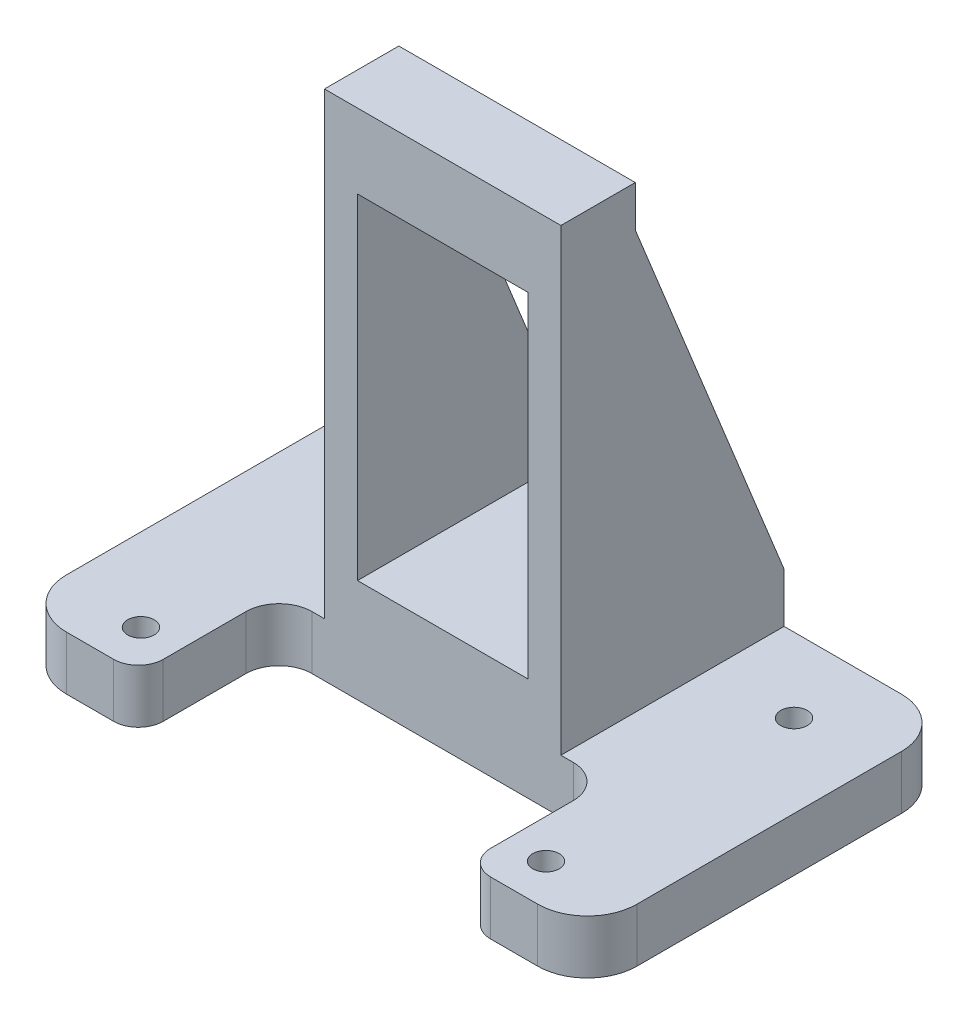
from build123d import *

# Parameters (mm, degrees)
SKETCH2_W                      = 69
SKETCH2_H                      = 44
SKETCH2_R                      = 1.6
BOSS_EXTRUDE1_DEPTH            = 6.5
FILLET1_R                      = 6
SKETCH3_W                      = 28.6
SKETCH3_H                      = 55.5
SKETCH3_W_2                    = 20.6
SKETCH3_H_2                    = 40.5
BOSS_EXTRUDE2_DEPTH            = 44
CUT_EXTRUDE1_REACH             = 82.964
CUT_EXTRUDE1_DIRECTION_2_REACH = 82.964
SKETCH5_W                      = 39.6
SKETCH5_H                      = 62
CUT_EXTRUDE2_DEPTH             = 17
FILLET2_R                      = 3
FILLET3_R                      = 4
SKETCH6_W                      = 0.467291508
SKETCH6_H                      = 0.623947972
SKETCH6_W_2                    = 0.444529457
SKETCH6_W_3                    = 0.492061974
SKETCH6_W_4                    = 0.846882173
SKETCH6_H_2                    = 1.118687835
SKETCH6_W_5                    = 1.920045906
SKETCH6_H_3                    = 0.481350421
SKETCH6_H_4                    = 0.44252104
SKETCH6_W_6                    = 0.953997705
SKETCH6_H_5                    = 0.365531752
SKETCH6_H_6                    = 0.359506503
CUT_EXTRUDE5_DEPTH             = 5


with BuildPart() as part:
    # Sketch2 → Boss-Extrude1 (new body)
    with BuildSketch(Plane(origin=(0, 0, 0), x_dir=(1, 0, 0), z_dir=(0, 1, 0))):
        with Locations((0, 17)):
            Rectangle(SKETCH2_W, SKETCH2_H)
        with Locations(Location((24.5, 30, 0), (0, 0, 90))):
            Circle(SKETCH2_R, mode=Mode.SUBTRACT)
        with Locations(Location((24.5, 0, 0), (0, 0, 90))):
            Circle(SKETCH2_R, mode=Mode.SUBTRACT)
        with Locations(Location((-24.5, 0, 0), (0, 0, 90))):
            Circle(SKETCH2_R, mode=Mode.SUBTRACT)
        with Locations(Location((-24.5, 30, 0), (0, 0, 90))):
            Circle(SKETCH2_R, mode=Mode.SUBTRACT)
    extrude(amount=BOSS_EXTRUDE1_DEPTH)

    # Fillet1
    fillet1_edges = [part.edges().sort_by_distance(p)[0] for p in [
        (34.5, 3.25, 5),
        (-34.5, 3.25, 5),
        (-34.5, 3.25, -39),
        (34.5, 3.25, -39),
    ]]
    fillet(fillet1_edges, radius=FILLET1_R)

    # Sketch3 → Boss-Extrude2 (add)
    with BuildSketch(Plane.XY.offset(5)):
        with Locations((0, 34.25)):
            Rectangle(SKETCH3_W, SKETCH3_H)
        with Locations((0, 32.75)):
            Rectangle(SKETCH3_W_2, SKETCH3_H_2, mode=Mode.SUBTRACT)
    extrude(amount=-BOSS_EXTRUDE2_DEPTH)

    # Sketch4 → Cut-Extrude1 (cut, up to next)
    with BuildSketch(Plane(origin=(0, 0, 0), x_dir=(0, 0, -1), z_dir=(1, 0, 0)), mode=Mode.PRIVATE) as cut_extrude1_sk1:
        Polygon((21, 62), (21, 57.019743081), (39, 12.5), (39, 62), align=None)
    cut_extrude1_tool1 = extrude(cut_extrude1_sk1.sketch, amount=-CUT_EXTRUDE1_REACH, mode=Mode.PRIVATE) & part.part
    add(cut_extrude1_tool1.solids().sort_by_distance((0, 45.348245, -32.451516))[0], mode=Mode.SUBTRACT)

    # Sketch4 → Cut-Extrude1 direction 2 (cut, up to next)
    with BuildSketch(Plane(origin=(0, 0, 0), x_dir=(0, 0, -1), z_dir=(1, 0, 0)), mode=Mode.PRIVATE) as cut_extrude1_direction_2_sk1:
        Polygon((21, 62), (21, 57.019743081), (39, 12.5), (39, 62), align=None)
    cut_extrude1_direction_2_tool1 = extrude(cut_extrude1_direction_2_sk1.sketch, amount=CUT_EXTRUDE1_DIRECTION_2_REACH, mode=Mode.PRIVATE) & part.part
    add(cut_extrude1_direction_2_tool1.solids().sort_by_distance((0, 45.348245, -32.451516))[0], mode=Mode.SUBTRACT)

    # Sketch5 → Cut-Extrude2 (cut)
    with BuildSketch(Plane.XY.offset(5)):
        with Locations((0, 31)):
            Rectangle(SKETCH5_W, SKETCH5_H)
    extrude(amount=-CUT_EXTRUDE2_DEPTH, mode=Mode.SUBTRACT)

    # Fillet2
    fillet2_edges = [part.edges().sort_by_distance(p)[0] for p in [
        (19.8, 3.25, 5),
        (-19.8, 3.25, 5),
    ]]
    fillet(fillet2_edges, radius=FILLET2_R)

    # Fillet3
    fillet3_edges = [part.edges().sort_by_distance(p)[0] for p in [
        (19.8, 3.25, -12),
        (-19.8, 3.25, -12),
    ]]
    fillet(fillet3_edges, radius=FILLET3_R)

    # Sketch6 → Cut-Extrude5 (cut)
    # profile 1 of 21: a face of its own
    with BuildSketch(Plane(origin=(0, 0, -39), x_dir=(-1, 0, 0), z_dir=(0, 0, -1))):
        with BuildLine():
            add(Edge.make_bspline(
                [(-13.767560839, 1.754288775), (-13.726954726, 1.774412419), (-13.645865316, 1.814598842), (-13.528546246, 1.881913475), (-13.414288971, 1.95293046), (-13.303796203, 2.02846619), (-13.197480084, 2.108961037), (-13.094436781, 2.193495554), (-12.995507151, 2.283358796), (-12.899919198, 2.377612316), (-12.807877718, 2.476132023), (-12.720200688, 2.579603783), (-12.635684842, 2.687242923), (-12.555418873, 2.800073095), (-12.478461811, 2.917007371), (-12.405274794, 3.038755733), (-12.335632493, 3.164845162), (-12.292820748, 3.251722794), (-12.271290755, 3.295413488)],
                knots=[0, 0, 0, 0, 0.992752868, 1.98250307, 2.962055896, 3.939874373, 4.913859045, 5.882971549, 6.85915056, 7.841067899, 8.823569395, 9.812123231, 10.811739634, 11.821196857, 12.84506874, 13.878145615, 14.932921057, 16, 16, 16, 16], degree=3))
            Line((-12.271290755, 3.295413488), (-12.942771245, 3.295413488))
            add(Edge.make_bspline(
                [(-12.942771245, 3.295413488), (-12.969330801, 3.294874004), (-13.026051842, 3.293721873), (-13.116726855, 3.289032479), (-13.218043916, 3.280090895), (-13.289127775, 3.272134581), (-13.326378743, 3.267965133)],
                knots=[0, 0, 0, 0, 0.828461791, 1.769277085, 2.83100624, 4, 4, 4, 4], degree=3))
            Line((-13.326378743, 3.267965133), (-13.326378743, 3.555168653))
            add(Edge.make_bspline(
                [(-13.326378743, 3.555168653), (-13.303171691, 3.552922231), (-13.258768729, 3.548624063), (-13.195160304, 3.542702361), (-13.137411474, 3.536978973), (-13.085809985, 3.533376254), (-13.04032913, 3.529573321), (-13.001021244, 3.527804718), (-12.967550694, 3.526327919), (-12.947235441, 3.52590319), (-12.93808494, 3.525711882)],
                knots=[0, 0, 0, 0, 1.436587287, 2.748678655, 3.936277234, 5.01193958, 5.935746121, 6.748039604, 7.436085514, 8, 8, 8, 8], degree=3))
            Line((-12.93808494, 3.525711882), (-12.183589913, 3.525711882))
            add(Edge.make_bspline(
                [(-12.183589913, 3.525711882), (-12.169174326, 3.563902483), (-12.139834628, 3.641630891), (-12.105925997, 3.764372032), (-12.0760012, 3.893165105), (-12.061671926, 3.981967563), (-12.054381803, 4.027146465)],
                knots=[0, 0, 0, 0, 0.943560697, 1.920406307, 2.941991457, 4, 4, 4, 4], degree=3))
            Line((-12.054381803, 4.027146465), (-11.727009959, 3.944131928))
            add(Edge.make_bspline(
                [(-11.727009959, 3.944131928), (-11.716610438, 3.941796732), (-11.698281217, 3.937680935), (-11.676006997, 3.928147377), (-11.660118824, 3.916285215), (-11.657795246, 3.905587756), (-11.656715392, 3.900616243)],
                knots=[0, 0, 0, 0, 1.446951417, 2.550261057, 3.326251564, 4, 4, 4, 4], degree=3))
            add(Edge.make_bspline(
                [(-11.656715392, 3.900616243), (-11.656623227, 3.89595572), (-11.656426499, 3.886007755), (-11.668700942, 3.873584815), (-11.684396011, 3.860564614), (-11.69884103, 3.854480527), (-11.706925797, 3.851075309)],
                knots=[0, 0, 0, 0, 0.715141777, 1.526482245, 2.615591032, 4, 4, 4, 4], degree=3))
            add(Edge.make_bspline(
                [(-11.706925797, 3.851075309), (-11.715870466, 3.846070619), (-11.733935102, 3.835963156), (-11.757155476, 3.813827338), (-11.775807308, 3.785886067), (-11.785121369, 3.764873479), (-11.789940334, 3.754001859)],
                knots=[0, 0, 0, 0, 0.937621593, 1.893618818, 2.910187783, 4, 4, 4, 4], degree=3))
            add(Edge.make_bspline(
                [(-11.789940334, 3.754001859), (-11.805343882, 3.718075961), (-11.837963843, 3.641995995), (-11.870507249, 3.56588325), (-11.887683257, 3.525711882)],
                knots=[0, 0, 0, 0, 0.944424667, 2, 2, 2, 2], degree=3))
            Line((-11.887683257, 3.525711882), (-10.570162216, 3.525711882))
            add(Edge.make_bspline(
                [(-10.570162216, 3.525711882), (-10.540253538, 3.526201105), (-10.476380153, 3.527245897), (-10.374343992, 3.532861447), (-10.260309796, 3.542390462), (-10.180291306, 3.550774491), (-10.138352729, 3.555168653)],
                knots=[0, 0, 0, 0, 0.828936389, 1.770287991, 2.831383235, 4, 4, 4, 4], degree=3))
            Line((-10.138352729, 3.555168653), (-10.138352729, 3.267965133))
            add(Edge.make_bspline(
                [(-10.138352729, 3.267965133), (-10.178727907, 3.272148297), (-10.25650592, 3.280206669), (-10.368764333, 3.289143952), (-10.472380693, 3.293788173), (-10.538470374, 3.29488671), (-10.570162216, 3.295413488)],
                knots=[0, 0, 0, 0, 1.125251069, 2.167663318, 3.121343535, 4, 4, 4, 4], degree=3))
            Line((-10.570162216, 3.295413488), (-11.975384099, 3.295413488))
            add(Edge.make_bspline(
                [(-11.975384099, 3.295413488), (-12.011477192, 3.225088767), (-12.081887513, 3.087899468), (-12.152964562, 2.951054426), (-12.187606746, 2.884357635)],
                knots=[0, 0, 0, 0, 1.025221668, 2, 2, 2, 2], degree=3))
            Line((-12.187606746, 2.884357635), (-10.852679431, 2.884357635))
            add(Edge.make_bspline(
                [(-10.852679431, 2.884357635), (-10.821211549, 2.884911075), (-10.752671837, 2.886116515), (-10.641701219, 2.890744507), (-10.514323263, 2.900012756), (-10.42398842, 2.907278161), (-10.376015315, 2.911136518)],
                knots=[0, 0, 0, 0, 0.790875981, 1.722594806, 2.790564147, 4, 4, 4, 4], degree=3))
            add(Edge.make_bspline(
                [(-10.376015315, 2.911136518), (-10.402055503, 2.871882257), (-10.45450041, 2.792824219), (-10.539205865, 2.676959918), (-10.629365116, 2.562381008), (-10.726379982, 2.450055794), (-10.82770825, 2.338208742), (-10.935237073, 2.228247725), (-11.048261403, 2.119781517), (-11.12694571, 2.049512448), (-11.166661834, 2.01404394)],
                knots=[0, 0, 0, 0, 0.942332813, 1.897857206, 2.870552135, 3.858436333, 4.866622225, 5.889558173, 6.934748604, 8, 8, 8, 8], degree=3))
            add(Edge.make_bspline(
                [(-11.166661834, 2.01404394), (-11.112845861, 1.994940975), (-11.004506531, 1.956483947), (-10.837303635, 1.909034059), (-10.665984489, 1.866919965), (-10.489515508, 1.834037778), (-10.308900626, 1.807015672), (-10.123500116, 1.787761981), (-9.933658821, 1.77543196), (-9.805420694, 1.773393522), (-9.740686317, 1.772364521)],
                knots=[0, 0, 0, 0, 0.942629035, 1.897648437, 2.868143168, 3.854517374, 4.860184307, 5.882698472, 6.931189987, 8, 8, 8, 8], degree=3))
            add(Edge.make_bspline(
                [(-9.740686317, 1.772364521), (-9.766041043, 1.750623116), (-9.815207332, 1.708463551), (-9.874265572, 1.633043611), (-9.919326242, 1.551529962), (-9.935927525, 1.492502651), (-9.944205828, 1.463068423)],
                knots=[0, 0, 0, 0, 1.059958276, 2.055404357, 3.030318826, 4, 4, 4, 4], degree=3))
            add(Edge.make_bspline(
                [(-9.944205828, 1.463068423), (-10.012541717, 1.475069984), (-10.146786515, 1.498646864), (-10.343742007, 1.538028069), (-10.53270745, 1.581107343), (-10.71431354, 1.62637141), (-10.88828368, 1.675088163), (-11.054586652, 1.727412628), (-11.213191323, 1.782599595), (-11.315410828, 1.822908866), (-11.36549504, 1.842659089)],
                knots=[0, 0, 0, 0, 1.129677115, 2.219233206, 3.269945396, 4.285157696, 5.266405772, 6.211039584, 7.123467964, 8, 8, 8, 8], degree=3))
            add(Edge.make_bspline(
                [(-11.36549504, 1.842659089), (-11.406945661, 1.816958915), (-11.492275981, 1.764052491), (-11.630043982, 1.691577373), (-11.778801282, 1.619898006), (-11.940030322, 1.551472926), (-12.112376068, 1.483452525), (-12.29686563, 1.418198722), (-12.493485074, 1.355315582), (-12.628917691, 1.315917328), (-12.698413938, 1.295700405)],
                knots=[0, 0, 0, 0, 0.809469542, 1.66637541, 2.582735233, 3.550320492, 4.573350391, 5.658429552, 6.798440427, 8, 8, 8, 8], degree=3))
            add(Edge.make_bspline(
                [(-12.698413938, 1.295700405), (-12.733168937, 1.344889863), (-12.805286399, 1.446959175), (-12.889677481, 1.539155749), (-12.933398636, 1.586920757)],
                knots=[0, 0, 0, 0, 0.963844204, 2, 2, 2, 2], degree=3))
            add(Edge.make_bspline(
                [(-12.933398636, 1.586920757), (-12.871290667, 1.592298001), (-12.74870918, 1.60291098), (-12.568772624, 1.629785634), (-12.395565153, 1.665718694), (-12.228768452, 1.707908971), (-12.068872094, 1.759574389), (-11.915984256, 1.820285027), (-11.769007323, 1.887724058), (-11.676008782, 1.940410238), (-11.629936509, 1.966511423)],
                knots=[0, 0, 0, 0, 1.092223948, 2.155704598, 3.185671913, 4.191026073, 5.169212638, 6.127746863, 7.072469778, 8, 8, 8, 8], degree=3))
            add(Edge.make_bspline(
                [(-11.629936509, 1.966511423), (-11.687913786, 1.999322061), (-11.802306475, 2.064059442), (-11.964793863, 2.171426736), (-12.119097888, 2.282597273), (-12.215075469, 2.363137218), (-12.262587618, 2.403007215)],
                knots=[0, 0, 0, 0, 1.037940193, 2.047919049, 3.033653908, 4, 4, 4, 4], degree=3))
            Line((-12.262587618, 2.403007215), (-12.086516463, 2.554307903))
            add(Edge.make_bspline(
                [(-12.086516463, 2.554307903), (-12.040484288, 2.515146992), (-11.945856549, 2.43464442), (-11.787761104, 2.325508684), (-11.613351885, 2.220575576), (-11.488670065, 2.157622539), (-11.424408582, 2.125176304)],
                knots=[0, 0, 0, 0, 0.915898396, 1.882800343, 2.908787262, 4, 4, 4, 4], degree=3))
            add(Edge.make_bspline(
                [(-11.424408582, 2.125176304), (-11.377977913, 2.1621247), (-11.283080195, 2.237641992), (-11.146272926, 2.3639817), (-11.008564853, 2.501520241), (-10.920462759, 2.600699504), (-10.875441482, 2.651381354)],
                knots=[0, 0, 0, 0, 0.934642047, 1.910276076, 2.932124803, 4, 4, 4, 4], degree=3))
            Line((-10.875441482, 2.651381354), (-12.323509577, 2.651381354))
            add(Edge.make_bspline(
                [(-12.323509577, 2.651381354), (-12.363127859, 2.597618822), (-12.4425199, 2.489882777), (-12.571705325, 2.335823495), (-12.707146399, 2.185870091), (-12.850172765, 2.041367724), (-13.001463536, 1.902783155), (-13.159212856, 1.768481681), (-13.325531797, 1.640765046), (-13.440564005, 1.559956366), (-13.498433066, 1.519304078)],
                knots=[0, 0, 0, 0, 0.977172531, 1.958179818, 2.940860104, 3.933900563, 4.932414663, 5.942727056, 6.965051126, 8, 8, 8, 8], degree=3))
            add(Edge.make_bspline(
                [(-13.498433066, 1.519304078), (-13.515616134, 1.540248603), (-13.551142032, 1.583551291), (-13.614978147, 1.642347394), (-13.686941321, 1.700706265), (-13.740015436, 1.735981151), (-13.767560839, 1.754288775)],
                knots=[0, 0, 0, 0, 0.904768027, 1.870602863, 2.894845384, 4, 4, 4, 4], degree=3))
        make_face()
    # profile 2 of 21: a face of its own
    with BuildSketch(Plane(origin=(0, 0, -39), x_dir=(-1, 0, 0), z_dir=(0, 0, -1))):
        with BuildLine():
            add(Edge.make_bspline(
                [(-13.622954871, 4.359874085), (-13.584588674, 4.355694066), (-13.510830977, 4.347658123), (-13.404599198, 4.338712768), (-13.307227804, 4.334071567), (-13.245376259, 4.332956734), (-13.215915851, 4.33242573)],
                knots=[0, 0, 0, 0, 1.13463676, 2.181300207, 3.133738069, 4, 4, 4, 4], degree=3))
            Line((-13.215915851, 4.33242573), (-12.685024496, 4.33242573))
            add(Edge.make_bspline(
                [(-12.685024496, 4.33242573), (-12.712371248, 4.369716744), (-12.768226754, 4.445883319), (-12.860214691, 4.558069083), (-12.962913621, 4.66947547), (-13.036006603, 4.742404879), (-13.073318299, 4.779633075)],
                knots=[0, 0, 0, 0, 0.935575467, 1.910904887, 2.93358187, 4, 4, 4, 4], degree=3))
            Line((-13.073318299, 4.779633075), (-12.883857702, 4.947001094))
            add(Edge.make_bspline(
                [(-12.883857702, 4.947001094), (-12.84477414, 4.907971005), (-12.768932102, 4.832232732), (-12.662599677, 4.717824229), (-12.564396001, 4.608551498), (-12.504024704, 4.535260294), (-12.474810265, 4.499793749)],
                knots=[0, 0, 0, 0, 1.093020778, 2.121017641, 3.090736529, 4, 4, 4, 4], degree=3))
            Line((-12.474810265, 4.499793749), (-12.664940334, 4.33242573))
            Line((-12.664940334, 4.33242573), (-11.634622813, 4.33242573))
            add(Edge.make_bspline(
                [(-11.634622813, 4.33242573), (-11.669543564, 4.380614147), (-11.738408445, 4.475643306), (-11.850146469, 4.608965556), (-11.966279773, 4.733023894), (-12.049384864, 4.808078836), (-12.090533295, 4.845241339)],
                knots=[0, 0, 0, 0, 1.038013863, 2.046997801, 3.032995726, 4, 4, 4, 4], degree=3))
            Line((-12.090533295, 4.845241339), (-11.905759003, 5.021312494))
            add(Edge.make_bspline(
                [(-11.905759003, 5.021312494), (-11.86270497, 4.979568465), (-11.777388548, 4.896847965), (-11.654320812, 4.770333443), (-11.536673974, 4.642855894), (-11.461675137, 4.556228111), (-11.424408582, 4.51318319)],
                knots=[0, 0, 0, 0, 1.027665969, 2.036435988, 3.024314658, 4, 4, 4, 4], degree=3))
            Line((-11.424408582, 4.51318319), (-11.609182874, 4.33242573))
            Line((-11.609182874, 4.33242573), (-11.069588383, 4.33242573))
            add(Edge.make_bspline(
                [(-11.069588383, 4.33242573), (-11.039741911, 4.37292024), (-10.982050934, 4.45119307), (-10.901138481, 4.5665944), (-10.827333449, 4.674813302), (-10.761383938, 4.776634211), (-10.703887011, 4.872392368), (-10.653656824, 4.961452726), (-10.610008855, 5.0436141), (-10.586166536, 5.097494889), (-10.574848521, 5.123072249)],
                knots=[0, 0, 0, 0, 1.291886543, 2.497119162, 3.619358956, 4.655846174, 5.612182313, 6.487257466, 7.281896931, 8, 8, 8, 8], degree=3))
            Line((-10.574848521, 5.123072249), (-10.249485093, 4.974449449))
            add(Edge.make_bspline(
                [(-10.249485093, 4.974449449), (-10.243327734, 4.972258226), (-10.232308284, 4.968336729), (-10.219231137, 4.959681204), (-10.210432739, 4.949705104), (-10.209227069, 4.94200211), (-10.208647297, 4.938297957)],
                knots=[0, 0, 0, 0, 1.348611615, 2.413527653, 3.237110066, 4, 4, 4, 4], degree=3))
            add(Edge.make_bspline(
                [(-10.208647297, 4.938297957), (-10.21391742, 4.932279179), (-10.227256169, 4.917045576), (-10.246529667, 4.910264923), (-10.25818823, 4.906163297)],
                knots=[0, 0, 0, 0, 0.790197525, 2, 2, 2, 2], degree=3))
            add(Edge.make_bspline(
                [(-10.25818823, 4.906163297), (-10.278329142, 4.900662554), (-10.317492459, 4.889966545), (-10.3705511, 4.861693926), (-10.416592961, 4.825328417), (-10.440397904, 4.794894479), (-10.452335132, 4.779633075)],
                knots=[0, 0, 0, 0, 1.05415915, 2.049776658, 3.022040929, 4, 4, 4, 4], degree=3))
            add(Edge.make_bspline(
                [(-10.452335132, 4.779633075), (-10.512695931, 4.705632393), (-10.633856303, 4.557093103), (-10.753707458, 4.40749544), (-10.813850051, 4.33242573)],
                knots=[0, 0, 0, 0, 0.996378571, 2, 2, 2, 2], degree=3))
            Line((-10.813850051, 4.33242573), (-10.23542618, 4.33242573))
            add(Edge.make_bspline(
                [(-10.23542618, 4.33242573), (-10.209982164, 4.332954708), (-10.157050489, 4.334055151), (-10.074829376, 4.338602461), (-9.986675308, 4.347642754), (-9.926109346, 4.355694042), (-9.894664894, 4.359874085)],
                knots=[0, 0, 0, 0, 0.892631001, 1.856957413, 2.887381659, 4, 4, 4, 4], degree=3))
            add(Edge.make_bspline(
                [(-9.894664894, 4.359874085), (-9.898494659, 4.319486582), (-9.905580159, 4.244765118), (-9.914814449, 4.141952448), (-9.919590414, 4.05709155), (-9.920875501, 4.006619454), (-9.921443777, 3.984300252)],
                knots=[0, 0, 0, 0, 1.292583639, 2.391426384, 3.288674681, 4, 4, 4, 4], degree=3))
            Line((-9.921443777, 3.984300252), (-9.921443777, 3.87383736))
            add(Edge.make_bspline(
                [(-9.921443777, 3.87383736), (-9.921714995, 3.857760874), (-9.922322502, 3.821750692), (-9.916503935, 3.761682497), (-9.908138898, 3.689506479), (-9.899388214, 3.637478703), (-9.894664894, 3.609395891)],
                knots=[0, 0, 0, 0, 0.724288007, 1.622353393, 2.716627769, 4, 4, 4, 4], degree=3))
            Line((-9.894664894, 3.609395891), (-10.199274688, 3.609395891))
            add(Edge.make_bspline(
                [(-10.199274688, 3.609395891), (-10.194789644, 3.634799132), (-10.186198732, 3.683457961), (-10.177740463, 3.75387077), (-10.171938157, 3.818176255), (-10.170954382, 3.859098212), (-10.170487389, 3.878523664)],
                knots=[0, 0, 0, 0, 1.142137288, 2.187715438, 3.139717382, 4, 4, 4, 4], degree=3))
            Line((-10.170487389, 3.878523664), (-10.170487389, 4.099449449))
            Line((-10.170487389, 4.099449449), (-13.344454489, 4.099449449))
            Line((-13.344454489, 4.099449449), (-13.344454489, 3.869151055))
            add(Edge.make_bspline(
                [(-13.344454489, 3.869151055), (-13.343898604, 3.851070545), (-13.342675757, 3.811296633), (-13.337955872, 3.746042383), (-13.328755886, 3.670018323), (-13.321529408, 3.615635572), (-13.317675606, 3.58663384)],
                knots=[0, 0, 0, 0, 0.764398236, 1.68154037, 2.763590603, 4, 4, 4, 4], degree=3))
            Line((-13.317675606, 3.58663384), (-13.622954871, 3.58663384))
            add(Edge.make_bspline(
                [(-13.622954871, 3.58663384), (-13.618811677, 3.615179983), (-13.611022566, 3.668846074), (-13.601965738, 3.744478011), (-13.597261914, 3.810180439), (-13.596058015, 3.850624074), (-13.595506516, 3.869151055)],
                knots=[0, 0, 0, 0, 1.21854157, 2.290830173, 3.217039755, 4, 4, 4, 4], degree=3))
            Line((-13.595506516, 3.869151055), (-13.595506516, 3.998359166))
            add(Edge.make_bspline(
                [(-13.595506516, 3.998359166), (-13.596041025, 4.024026348), (-13.597171152, 4.07829518), (-13.601834944, 4.164292181), (-13.610795093, 4.25913931), (-13.61878173, 4.325302694), (-13.622954871, 4.359874085)],
                knots=[0, 0, 0, 0, 0.849207368, 1.795502522, 2.848115981, 4, 4, 4, 4], degree=3))
        make_face()
    # profile 3 of 21: a face of its own
    with BuildSketch(Plane(origin=(0, 0, -39), x_dir=(-1, 0, 0), z_dir=(0, 0, -1))):
        with BuildLine():
            Line((-10.407480503, 5.563584873), (-10.203960992, 5.313202318))
            add(Edge.make_bspline(
                [(-10.203960992, 5.313202318), (-10.200006466, 5.307022702), (-10.193134507, 5.296284103), (-10.186077631, 5.281476682), (-10.182792238, 5.269544858), (-10.18500506, 5.263419828), (-10.185885246, 5.260983496)],
                knots=[0, 0, 0, 0, 1.530914818, 2.660340318, 3.467128072, 4, 4, 4, 4], degree=3))
            add(Edge.make_bspline(
                [(-10.185885246, 5.260983496), (-10.187515754, 5.258756456), (-10.191587335, 5.253195262), (-10.204877466, 5.250388184), (-10.222491394, 5.24753956), (-10.236710226, 5.247574295), (-10.244798789, 5.247594055)],
                knots=[0, 0, 0, 0, 0.515821894, 1.288071067, 2.457284798, 4, 4, 4, 4], degree=3))
            add(Edge.make_bspline(
                [(-10.244798789, 5.247594055), (-10.256850347, 5.24796699), (-10.282743705, 5.24876826), (-10.323801936, 5.2467486), (-10.369825786, 5.245251012), (-10.420679784, 5.240783834), (-10.476704749, 5.235554258), (-10.537625398, 5.228776715), (-10.603239769, 5.220760247), (-10.648497384, 5.21462043), (-10.671921972, 5.211442563)],
                knots=[0, 0, 0, 0, 0.674132758, 1.448406887, 2.297994882, 3.249563299, 4.30277873, 5.445460075, 6.67781265, 8, 8, 8, 8], degree=3))
            add(Edge.make_bspline(
                [(-10.671921972, 5.211442563), (-10.771868493, 5.199152774), (-10.973860932, 5.174315048), (-11.280309759, 5.141137703), (-11.592960343, 5.110248978), (-11.911906815, 5.082376926), (-12.237025485, 5.056071425), (-12.568438068, 5.032771503), (-12.905858013, 5.011865193), (-13.132889424, 5.000343822), (-13.247381038, 4.994533611)],
                knots=[0, 0, 0, 0, 0.934846586, 1.889329814, 2.861503177, 3.851471112, 4.861561527, 5.889621024, 6.935738923, 8, 8, 8, 8], degree=3))
            add(Edge.make_bspline(
                [(-13.247381038, 4.994533611), (-13.256913119, 5.023868076), (-13.275398953, 5.080757231), (-13.307169894, 5.162298868), (-13.340927974, 5.237953499), (-13.366279036, 5.285440999), (-13.378597565, 5.308516013)],
                knots=[0, 0, 0, 0, 1.085648545, 2.105428881, 3.079394473, 4, 4, 4, 4], degree=3))
            add(Edge.make_bspline(
                [(-13.378597565, 5.308516013), (-13.324625424, 5.303007846), (-13.212817616, 5.291597217), (-13.038616228, 5.281389558), (-12.852883981, 5.275715507), (-12.655558307, 5.273337122), (-12.44664374, 5.277299462), (-12.225924194, 5.284735995), (-11.993527362, 5.295666412), (-11.834995662, 5.307262367), (-11.753788842, 5.313202318)],
                knots=[0, 0, 0, 0, 0.800218856, 1.657720358, 2.573335627, 3.541191525, 4.568382315, 5.655297966, 6.798941815, 8, 8, 8, 8], degree=3))
            add(Edge.make_bspline(
                [(-11.753788842, 5.313202318), (-11.678999856, 5.320261588), (-11.53440643, 5.33390964), (-11.325908191, 5.358579899), (-11.133258585, 5.385975269), (-10.956802447, 5.415653663), (-10.796544835, 5.448561897), (-10.652047106, 5.482909907), (-10.523622775, 5.520361747), (-10.444602552, 5.549769653), (-10.407480503, 5.563584873)],
                knots=[0, 0, 0, 0, 1.312726882, 2.537962939, 3.66854334, 4.712916643, 5.664334616, 6.526947148, 7.307990545, 8, 8, 8, 8], degree=3))
        make_face()
    # profile 4 of 21: a face of its own
    with BuildSketch(Plane(origin=(0, 0, -39), x_dir=(-1, 0, 0), z_dir=(0, 0, -1))):
        with BuildLine():
            add(Edge.make_bspline(
                [(-9.264022201, 3.318175539), (-9.204033906, 3.36154872), (-9.085140457, 3.447511941), (-8.919548361, 3.589404758), (-8.765491298, 3.738318965), (-8.623619386, 3.895352879), (-8.494547489, 4.06100158), (-8.376694617, 4.234140907), (-8.271846187, 4.415723196), (-8.212092404, 4.542203032), (-8.18215533, 4.605570336)],
                knots=[0, 0, 0, 0, 1.043141335, 2.067447839, 3.07076823, 4.061942711, 5.048017259, 6.028713129, 7.012371164, 8, 8, 8, 8], degree=3))
            Line((-8.18215533, 4.605570336), (-7.903654948, 4.429499181))
            add(Edge.make_bspline(
                [(-7.903654948, 4.429499181), (-7.893698897, 4.423369059), (-7.877125535, 4.413164539), (-7.868296744, 4.383823917), (-7.8877327, 4.359492331), (-7.90645917, 4.350949469), (-7.917713861, 4.345815172)],
                knots=[0, 0, 0, 0, 1.151246642, 1.916425173, 2.747762317, 4, 4, 4, 4], degree=3))
            add(Edge.make_bspline(
                [(-7.917713861, 4.345815172), (-7.932059936, 4.338459838), (-7.961018905, 4.323612371), (-7.999703384, 4.292584678), (-8.036169281, 4.256239663), (-8.056063091, 4.227455144), (-8.066336662, 4.212590229)],
                knots=[0, 0, 0, 0, 0.954735051, 1.927226936, 2.929577502, 4, 4, 4, 4], degree=3))
            add(Edge.make_bspline(
                [(-8.066336662, 4.212590229), (-8.0763208, 4.198044155), (-8.099694111, 4.163991149), (-8.141134287, 4.107124669), (-8.192786738, 4.03651877), (-8.230976714, 3.985379251), (-8.251780426, 3.957521369)],
                knots=[0, 0, 0, 0, 0.671276115, 1.571487169, 2.677085247, 4, 4, 4, 4], degree=3))
            add(Edge.make_bspline(
                [(-8.251780426, 3.957521369), (-8.26241072, 3.942065692), (-8.282553244, 3.912779923), (-8.31236137, 3.872129077), (-8.338080949, 3.835747634), (-8.355035689, 3.81375874), (-8.36291279, 3.803542792)],
                knots=[0, 0, 0, 0, 1.185193402, 2.245731396, 3.184974156, 4, 4, 4, 4], degree=3))
            Line((-8.36291279, 3.803542792), (-8.36291279, 1.754288775))
            add(Edge.make_bspline(
                [(-8.36291279, 1.754288775), (-8.362425229, 1.728172909), (-8.36138677, 1.672548623), (-8.355776901, 1.583892572), (-8.346217205, 1.485035777), (-8.337847501, 1.41574201), (-8.333456019, 1.379384414)],
                knots=[0, 0, 0, 0, 0.832947265, 1.774097592, 2.832096118, 4, 4, 4, 4], degree=3))
            Line((-8.333456019, 1.379384414), (-8.640743701, 1.379384414))
            add(Edge.make_bspline(
                [(-8.640743701, 1.379384414), (-8.636373045, 1.416860413), (-8.628133622, 1.487508977), (-8.618468166, 1.587466183), (-8.612878482, 1.675004661), (-8.611788775, 1.729289068), (-8.61128693, 1.754288775)],
                knots=[0, 0, 0, 0, 1.203327663, 2.268475102, 3.202577351, 4, 4, 4, 4], degree=3))
            Line((-8.61128693, 1.754288775), (-8.61128693, 3.517008745))
            add(Edge.make_bspline(
                [(-8.61128693, 3.517008745), (-8.638460898, 3.487504842), (-8.695793163, 3.425256827), (-8.787237797, 3.328134407), (-8.88995886, 3.223953271), (-8.96203496, 3.152090614), (-8.999580732, 3.114656029)],
                knots=[0, 0, 0, 0, 0.86071765, 1.815961982, 2.862294255, 4, 4, 4, 4], degree=3))
            add(Edge.make_bspline(
                [(-8.999580732, 3.114656029), (-9.016786087, 3.134260056), (-9.05195416, 3.174331061), (-9.114170635, 3.227967867), (-9.185638226, 3.276069854), (-9.237431173, 3.30389158), (-9.264022201, 3.318175539)],
                knots=[0, 0, 0, 0, 0.930425011, 1.901806459, 2.922766001, 4, 4, 4, 4], degree=3))
        make_face()
    # profile 5 of 21: a face of its own
    with BuildSketch(Plane(origin=(0, 0, -39), x_dir=(-1, 0, 0), z_dir=(0, 0, -1))):
        with BuildLine():
            Line((-8.269856172, 5.640574162), (-7.983322125, 5.466511423))
            add(Edge.make_bspline(
                [(-7.983322125, 5.466511423), (-7.976899146, 5.462720638), (-7.965425929, 5.455949247), (-7.952229207, 5.443919706), (-7.944098391, 5.431412901), (-7.944369861, 5.422853438), (-7.944492744, 5.418978905)],
                knots=[0, 0, 0, 0, 1.371516588, 2.449908123, 3.298334403, 4, 4, 4, 4], degree=3))
            add(Edge.make_bspline(
                [(-7.944492744, 5.418978905), (-7.945980913, 5.414562025), (-7.949256343, 5.404840559), (-7.961816337, 5.39301219), (-7.979173915, 5.381932367), (-7.993424842, 5.376925494), (-8.001397871, 5.374124277)],
                knots=[0, 0, 0, 0, 0.731357257, 1.609702691, 2.662689824, 4, 4, 4, 4], degree=3))
            add(Edge.make_bspline(
                [(-8.001397871, 5.374124277), (-8.016364496, 5.367190382), (-8.04663479, 5.353166446), (-8.0879844, 5.323977086), (-8.126063962, 5.288654153), (-8.148108168, 5.261496763), (-8.15939328, 5.247594055)],
                knots=[0, 0, 0, 0, 0.965151741, 1.952038332, 2.951585009, 4, 4, 4, 4], degree=3))
            add(Edge.make_bspline(
                [(-8.15939328, 5.247594055), (-8.217549765, 5.173924602), (-8.333742276, 5.026738286), (-8.514054499, 4.809930694), (-8.698685605, 4.596159214), (-8.82566669, 4.456459492), (-8.88911784, 4.386652968)],
                knots=[0, 0, 0, 0, 0.997673674, 1.993280881, 2.997262959, 4, 4, 4, 4], degree=3))
            add(Edge.make_bspline(
                [(-8.88911784, 4.386652968), (-8.912218651, 4.406055339), (-8.958702092, 4.445096781), (-9.035426262, 4.496402319), (-9.116669941, 4.544134846), (-9.174098985, 4.571610941), (-9.203100242, 4.585486174)],
                knots=[0, 0, 0, 0, 0.970156943, 1.952149372, 2.965850026, 4, 4, 4, 4], degree=3))
            add(Edge.make_bspline(
                [(-9.203100242, 4.585486174), (-9.155231627, 4.613176482), (-9.058958822, 4.668866909), (-8.924023032, 4.768831152), (-8.795758669, 4.881314971), (-8.675754529, 5.00757394), (-8.561666442, 5.146083683), (-8.456467256, 5.298618724), (-8.357206557, 5.463593501), (-8.299373985, 5.580768106), (-8.269856172, 5.640574162)],
                knots=[0, 0, 0, 0, 0.925927033, 1.862213696, 2.808015252, 3.781171961, 4.777419729, 5.811509422, 6.882991852, 8, 8, 8, 8], degree=3))
        make_face()
    # profile 6 of 21: a face of its own
    with BuildSketch(Plane(origin=(0, 0, -39), x_dir=(-1, 0, 0), z_dir=(0, 0, -1))):
        with BuildLine():
            Line((-7.714194351, 2.619916166), (-7.422973999, 2.47263231))
            add(Edge.make_bspline(
                [(-7.422973999, 2.47263231), (-7.416877017, 2.468719289), (-7.406112976, 2.461810965), (-7.39259888, 2.451261589), (-7.384492924, 2.440449372), (-7.382843177, 2.432984891), (-7.382136203, 2.429786098)],
                knots=[0, 0, 0, 0, 1.422212294, 2.510873694, 3.36185676, 4, 4, 4, 4], degree=3))
            add(Edge.make_bspline(
                [(-7.382136203, 2.429786098), (-7.382860912, 2.427234637), (-7.384768528, 2.420518561), (-7.394792115, 2.411781033), (-7.408873062, 2.401075525), (-7.420429964, 2.393766893), (-7.426990832, 2.389617773)],
                knots=[0, 0, 0, 0, 0.509562969, 1.341296113, 2.490650519, 4, 4, 4, 4], degree=3))
            add(Edge.make_bspline(
                [(-7.426990832, 2.389617773), (-7.437069791, 2.381868227), (-7.457811134, 2.36592055), (-7.484818226, 2.3356306), (-7.511355837, 2.301872296), (-7.525946081, 2.276244946), (-7.533436891, 2.263087551)],
                knots=[0, 0, 0, 0, 0.913494561, 1.87986702, 2.911497781, 4, 4, 4, 4], degree=3))
            add(Edge.make_bspline(
                [(-7.533436891, 2.263087551), (-7.558521333, 2.212914465), (-7.609827297, 2.110293937), (-7.695362234, 1.956474113), (-7.789007105, 1.798478302), (-7.856058855, 1.69296666), (-7.890265506, 1.639139579)],
                knots=[0, 0, 0, 0, 0.93587182, 1.914166852, 2.935905944, 4, 4, 4, 4], degree=3))
            add(Edge.make_bspline(
                [(-7.890265506, 1.639139579), (-7.917579225, 1.652385411), (-7.970555727, 1.678076452), (-8.049888278, 1.710503038), (-8.125403459, 1.738993019), (-8.175783687, 1.752446618), (-8.200231076, 1.75897508)],
                knots=[0, 0, 0, 0, 1.093842587, 2.12156952, 3.088477327, 4, 4, 4, 4], degree=3))
            add(Edge.make_bspline(
                [(-8.200231076, 1.75897508), (-8.171195559, 1.787312194), (-8.113027974, 1.844080651), (-8.034404658, 1.93722731), (-7.96324712, 2.036565746), (-7.897836352, 2.140706496), (-7.840984103, 2.252082506), (-7.790952011, 2.36906893), (-7.747555296, 2.491986224), (-7.725414415, 2.576890341), (-7.714194351, 2.619916166)],
                knots=[0, 0, 0, 0, 0.97048266, 1.944192448, 2.912026728, 3.893031417, 4.884230702, 5.900995197, 6.93631291, 8, 8, 8, 8], degree=3))
        make_face()
    # profile 7 of 21: a face of its own
    with BuildSketch(Plane(origin=(0, 0, -39), x_dir=(-1, 0, 0), z_dir=(0, 0, -1))):
        with BuildLine():
            Line((-5.109278513, 3.193653733), (-5.109278513, 2.906450214))
            add(Edge.make_bspline(
                [(-5.109278513, 2.906450214), (-5.145167432, 2.911491663), (-5.213455893, 2.921084397), (-5.311129735, 2.929236529), (-5.39864943, 2.934865789), (-5.453603222, 2.934208346), (-5.47949657, 2.933898569)],
                knots=[0, 0, 0, 0, 1.169915987, 2.226084405, 3.164159353, 4, 4, 4, 4], degree=3))
            Line((-5.47949657, 2.933898569), (-7.560215774, 2.933898569))
            add(Edge.make_bspline(
                [(-7.560215774, 2.933898569), (-7.584320557, 2.93334799), (-7.636802856, 2.932149238), (-7.721900123, 2.927459137), (-7.819848704, 2.918365079), (-7.889386499, 2.910590408), (-7.926416998, 2.906450214)],
                knots=[0, 0, 0, 0, 0.787497024, 1.714583176, 2.782962211, 4, 4, 4, 4], degree=3))
            Line((-7.926416998, 2.906450214), (-7.926416998, 3.193653733))
            add(Edge.make_bspline(
                [(-7.926416998, 3.193653733), (-7.892957432, 3.189740098), (-7.827892677, 3.182129727), (-7.733298736, 3.173066084), (-7.644613513, 3.168494952), (-7.587667914, 3.167401822), (-7.560215774, 3.16687485)],
                knots=[0, 0, 0, 0, 1.100341269, 2.13970007, 3.103192941, 4, 4, 4, 4], degree=3))
            Line((-7.560215774, 3.16687485), (-5.47949657, 3.16687485))
            add(Edge.make_bspline(
                [(-5.47949657, 3.16687485), (-5.454276328, 3.16742292), (-5.400009851, 3.168602204), (-5.313117561, 3.173194546), (-5.214986558, 3.182494675), (-5.14586832, 3.189791134), (-5.109278513, 3.193653733)],
                knots=[0, 0, 0, 0, 0.815164759, 1.753992673, 2.811008848, 4, 4, 4, 4], degree=3))
        make_face()
    # profile 8 of 21: a face of its own
    with BuildSketch(Plane(origin=(0, 0, -39), x_dir=(-1, 0, 0), z_dir=(0, 0, -1))):
        with BuildLine():
            Line((-7.479209653, 5.119055417), (-6.654420059, 5.119055417))
            add(Edge.make_bspline(
                [(-6.654420059, 5.119055417), (-6.644876208, 5.167187381), (-6.626289333, 5.260925515), (-6.605731972, 5.398762451), (-6.591163983, 5.529861535), (-6.586431484, 5.615105089), (-6.584125491, 5.656641492)],
                knots=[0, 0, 0, 0, 1.084787782, 2.112649739, 3.08035578, 4, 4, 4, 4], degree=3))
            Line((-6.584125491, 5.656641492), (-6.243364206, 5.563584873))
            add(Edge.make_bspline(
                [(-6.243364206, 5.563584873), (-6.237040233, 5.561765861), (-6.225908234, 5.558563878), (-6.212199264, 5.552040803), (-6.202706608, 5.544639497), (-6.199451787, 5.534318572), (-6.203170635, 5.523297763), (-6.212062827, 5.511875196), (-6.225696177, 5.498511395), (-6.237010106, 5.489594854), (-6.243364206, 5.484587169)],
                knots=[0, 0, 0, 0, 1.28921383, 2.269384955, 2.982960305, 3.579175124, 4.259670884, 5.171809516, 6.411638817, 8, 8, 8, 8], degree=3))
            add(Edge.make_bspline(
                [(-6.243364206, 5.484587169), (-6.254011095, 5.476987824), (-6.274879813, 5.462092528), (-6.299584519, 5.432241028), (-6.317440604, 5.397182059), (-6.323771767, 5.371399638), (-6.327048215, 5.358056947)],
                knots=[0, 0, 0, 0, 1.002192992, 1.964374876, 2.946541272, 4, 4, 4, 4], degree=3))
            add(Edge.make_bspline(
                [(-6.327048215, 5.358056947), (-6.336355403, 5.318988471), (-6.355358224, 5.239220953), (-6.375179208, 5.159652759), (-6.385292285, 5.119055417)],
                knots=[0, 0, 0, 0, 0.979558521, 2, 2, 2, 2], degree=3))
            Line((-6.385292285, 5.119055417), (-5.484182874, 5.119055417))
            add(Edge.make_bspline(
                [(-5.484182874, 5.119055417), (-5.45829303, 5.119597371), (-5.40313359, 5.120752028), (-5.315348574, 5.125357311), (-5.217652692, 5.134563511), (-5.149213918, 5.141955027), (-5.113295346, 5.1458343)],
                knots=[0, 0, 0, 0, 0.835264608, 1.779567536, 2.834655284, 4, 4, 4, 4], degree=3))
            Line((-5.113295346, 5.1458343), (-5.113295346, 4.85863078))
            add(Edge.make_bspline(
                [(-5.113295346, 4.85863078), (-5.150311376, 4.863767112), (-5.220211185, 4.873466385), (-5.319092368, 4.883709797), (-5.405797202, 4.888948967), (-5.459407639, 4.888359817), (-5.484182874, 4.888087551)],
                knots=[0, 0, 0, 0, 1.203822053, 2.273256539, 3.202012168, 4, 4, 4, 4], degree=3))
            Line((-5.484182874, 4.888087551), (-6.437511107, 4.888087551))
            Line((-6.437511107, 4.888087551), (-6.505127786, 4.592180895))
            Line((-6.505127786, 4.592180895), (-5.669626639, 4.592180895))
            add(Edge.make_bspline(
                [(-5.669626639, 4.592180895), (-5.643067288, 4.59272785), (-5.585455381, 4.593914292), (-5.49188793, 4.598654194), (-5.384336035, 4.607671938), (-5.30787558, 4.615481993), (-5.267273923, 4.61962925)],
                knots=[0, 0, 0, 0, 0.790127412, 1.713925404, 2.786059835, 4, 4, 4, 4], degree=3))
            add(Edge.make_bspline(
                [(-5.267273923, 4.61962925), (-5.271104963, 4.577679784), (-5.278214143, 4.499835044), (-5.287551038, 4.391668113), (-5.292204575, 4.300999029), (-5.293483924, 4.246290011), (-5.294052806, 4.221962838)],
                knots=[0, 0, 0, 0, 1.267930397, 2.352871741, 3.267580081, 4, 4, 4, 4], degree=3))
            Line((-5.294052806, 4.221962838), (-5.294052806, 3.869151055))
            add(Edge.make_bspline(
                [(-5.294052806, 3.869151055), (-5.293495648, 3.843707895), (-5.292273163, 3.787881829), (-5.287637559, 3.6969837), (-5.278317832, 3.591490945), (-5.271120193, 3.516333523), (-5.267273923, 3.476170948)],
                knots=[0, 0, 0, 0, 0.775043466, 1.700560251, 2.771226891, 4, 4, 4, 4], degree=3))
            add(Edge.make_bspline(
                [(-5.267273923, 3.476170948), (-5.303844486, 3.480479209), (-5.374875182, 3.488847108), (-5.478543524, 3.496214231), (-5.576048247, 3.502479009), (-5.639044374, 3.502795962), (-5.669626639, 3.502949831)],
                knots=[0, 0, 0, 0, 1.095001064, 2.126811276, 3.090636914, 4, 4, 4, 4], degree=3))
            Line((-5.669626639, 3.502949831), (-7.347993127, 3.502949831))
            add(Edge.make_bspline(
                [(-7.347993127, 3.502949831), (-7.408536909, 3.501687851), (-7.53394862, 3.499073756), (-7.658483231, 3.483978708), (-7.722897488, 3.476170948)],
                knots=[0, 0, 0, 0, 0.965520395, 2, 2, 2, 2], degree=3))
            add(Edge.make_bspline(
                [(-7.722897488, 3.476170948), (-7.718614691, 3.51252057), (-7.710506089, 3.581341153), (-7.703089627, 3.67896942), (-7.696743538, 3.76463187), (-7.696316012, 3.817815217), (-7.696118605, 3.842372173)],
                knots=[0, 0, 0, 0, 1.1953751, 2.26319851, 3.198046778, 4, 4, 4, 4], degree=3))
            Line((-7.696118605, 3.842372173), (-7.696118605, 4.248741721))
            add(Edge.make_bspline(
                [(-7.696118605, 4.248741721), (-7.695905114, 4.272622057), (-7.69543595, 4.32510089), (-7.699729847, 4.410920886), (-7.709644272, 4.510637983), (-7.718286553, 4.581710028), (-7.722897488, 4.61962925)],
                knots=[0, 0, 0, 0, 0.769826751, 1.691752186, 2.768475572, 4, 4, 4, 4], degree=3))
            add(Edge.make_bspline(
                [(-7.722897488, 4.61962925), (-7.689445075, 4.615430561), (-7.624418465, 4.607268924), (-7.529995957, 4.598443712), (-7.441542373, 4.593774669), (-7.384818432, 4.592700676), (-7.357365736, 4.592180895)],
                knots=[0, 0, 0, 0, 1.102960023, 2.143993325, 3.101748104, 4, 4, 4, 4], degree=3))
            Line((-7.357365736, 4.592180895), (-6.77425556, 4.592180895))
            Line((-6.77425556, 4.592180895), (-6.69994416, 4.888087551))
            Line((-6.69994416, 4.888087551), (-7.479209653, 4.888087551))
            add(Edge.make_bspline(
                [(-7.479209653, 4.888087551), (-7.505102646, 4.887605288), (-7.559836107, 4.886585863), (-7.64648801, 4.880989763), (-7.74178491, 4.87149275), (-7.808162967, 4.863035407), (-7.842732989, 4.85863078)],
                knots=[0, 0, 0, 0, 0.851456993, 1.799837846, 2.854144582, 4, 4, 4, 4], degree=3))
            Line((-7.842732989, 4.85863078), (-7.842732989, 5.1458343))
            add(Edge.make_bspline(
                [(-7.842732989, 5.1458343), (-7.807037021, 5.14196109), (-7.73926458, 5.134607407), (-7.64291139, 5.125388903), (-7.557358197, 5.120784689), (-7.50398368, 5.119603617), (-7.479209653, 5.119055417)],
                knots=[0, 0, 0, 0, 1.181533123, 2.243261315, 3.1846017, 4, 4, 4, 4], degree=3))
        make_face()
        with Locations((-7.211420824, 4.047900099)):
            Rectangle(SKETCH6_W, SKETCH6_H, mode=Mode.SUBTRACT)
        with Locations((-6.506466731, 4.047900099)):
            Rectangle(SKETCH6_W_2, SKETCH6_H, mode=Mode.SUBTRACT)
        with Locations((-5.789127404, 4.047900099)):
            Rectangle(SKETCH6_W_3, SKETCH6_H, mode=Mode.SUBTRACT)
    # profile 9 of 21: a face of its own
    with BuildSketch(Plane(origin=(0, 0, -39), x_dir=(-1, 0, 0), z_dir=(0, 0, -1))):
        with BuildLine():
            add(Edge.make_bspline(
                [(-5.829630464, 2.093041645), (-5.809140003, 2.066084065), (-5.76970829, 2.014207073), (-5.701357366, 1.949295548), (-5.63062805, 1.896237633), (-5.579056394, 1.872403525), (-5.55380797, 1.860734835)],
                knots=[0, 0, 0, 0, 1.110890193, 2.137789939, 3.088300213, 4, 4, 4, 4], degree=3))
            add(Edge.make_bspline(
                [(-5.55380797, 1.860734835), (-5.571906621, 1.826440615), (-5.606654913, 1.760597828), (-5.667171605, 1.671475082), (-5.732191261, 1.595798249), (-5.801538541, 1.53339542), (-5.874999116, 1.484098761), (-5.953497252, 1.449724383), (-6.035942159, 1.427248764), (-6.092813052, 1.423913964), (-6.121520288, 1.422230627)],
                knots=[0, 0, 0, 0, 1.228602702, 2.35884138, 3.407037955, 4.384062112, 5.308225892, 6.19820821, 7.090493202, 8, 8, 8, 8], degree=3))
            add(Edge.make_bspline(
                [(-6.121520288, 1.422230627), (-6.16411771, 1.418477137), (-6.253654376, 1.410587576), (-6.395309567, 1.406636891), (-6.550698307, 1.40739332), (-6.658890419, 1.411424259), (-6.715342018, 1.41352749)],
                knots=[0, 0, 0, 0, 0.863171996, 1.814324442, 2.859576018, 4, 4, 4, 4], degree=3))
            add(Edge.make_bspline(
                [(-6.715342018, 1.41352749), (-6.736547439, 1.413778875), (-6.777437021, 1.414263611), (-6.836701481, 1.418123404), (-6.891482646, 1.42541349), (-6.941911061, 1.435690415), (-6.988270155, 1.447217964), (-7.030154603, 1.462486928), (-7.066959827, 1.481692845), (-7.100440568, 1.502005101), (-7.128442561, 1.526386564), (-7.152564762, 1.552939602), (-7.172296555, 1.582608776), (-7.186620735, 1.615639427), (-7.197732182, 1.65080015), (-7.203624686, 1.688904039), (-7.204801227, 1.729794068), (-7.202543966, 1.757870937), (-7.201378743, 1.772364521)],
                knots=[0, 0, 0, 0, 1.446573019, 2.789369926, 4.048896284, 5.213286284, 6.29887673, 7.305600383, 8.24516363, 9.127876358, 9.970010446, 10.767767771, 11.570015458, 12.387714413, 13.215973843, 14.07944148, 15.008586861, 16, 16, 16, 16], degree=3))
            Line((-7.201378743, 1.772364521), (-7.201378743, 2.278485409))
            add(Edge.make_bspline(
                [(-7.201378743, 2.278485409), (-7.201579348, 2.303934498), (-7.202016137, 2.35934608), (-7.208425267, 2.449468084), (-7.215847081, 2.553779179), (-7.223882276, 2.627972209), (-7.228157626, 2.667448684)],
                knots=[0, 0, 0, 0, 0.782778527, 1.704383099, 2.77855289, 4, 4, 4, 4], degree=3))
            Line((-7.228157626, 2.667448684), (-6.884718452, 2.619916166))
            add(Edge.make_bspline(
                [(-6.884718452, 2.619916166), (-6.87681042, 2.618394899), (-6.862684096, 2.61567742), (-6.845408209, 2.608809561), (-6.8330231, 2.600008056), (-6.831268967, 2.592001117), (-6.830491214, 2.588450979)],
                knots=[0, 0, 0, 0, 1.439060869, 2.570632019, 3.366243087, 4, 4, 4, 4], degree=3))
            add(Edge.make_bspline(
                [(-6.830491214, 2.588450979), (-6.830665182, 2.583930698), (-6.831056221, 2.573770145), (-6.838856417, 2.557727328), (-6.85276096, 2.540545944), (-6.864697142, 2.5291657), (-6.871329011, 2.522842716)],
                knots=[0, 0, 0, 0, 0.675654504, 1.51871612, 2.621372334, 4, 4, 4, 4], degree=3))
            add(Edge.make_bspline(
                [(-6.871329011, 2.522842716), (-6.883066357, 2.507002257), (-6.908116908, 2.473194598), (-6.930927127, 2.408472768), (-6.946236381, 2.331423036), (-6.948896081, 2.275234972), (-6.950326715, 2.245011805)],
                knots=[0, 0, 0, 0, 0.800528383, 1.708535769, 2.767437418, 4, 4, 4, 4], degree=3))
            Line((-6.950326715, 2.245011805), (-6.950326715, 1.869437972))
            add(Edge.make_bspline(
                [(-6.950326715, 1.869437972), (-6.950520851, 1.850637528), (-6.950872675, 1.816566152), (-6.942779194, 1.771025592), (-6.927263578, 1.734907059), (-6.909233678, 1.720296667), (-6.900785782, 1.713450979)],
                knots=[0, 0, 0, 0, 1.318334337, 2.389170318, 3.245246926, 4, 4, 4, 4], degree=3))
            add(Edge.make_bspline(
                [(-6.900785782, 1.713450979), (-6.889821424, 1.707185649), (-6.863089687, 1.691910412), (-6.809324628, 1.679415098), (-6.738283018, 1.668096906), (-6.684392952, 1.664115841), (-6.654420059, 1.661901629)],
                knots=[0, 0, 0, 0, 0.594331628, 1.449014828, 2.581178101, 4, 4, 4, 4], degree=3))
            add(Edge.make_bspline(
                [(-6.654420059, 1.661901629), (-6.609350231, 1.660007761), (-6.523028343, 1.656380451), (-6.399086991, 1.656414575), (-6.286703066, 1.660601995), (-6.215893641, 1.667395443), (-6.182442247, 1.670604766)],
                knots=[0, 0, 0, 0, 1.145439843, 2.193851973, 3.146749621, 4, 4, 4, 4], degree=3))
            add(Edge.make_bspline(
                [(-6.182442247, 1.670604766), (-6.158828146, 1.67248882), (-6.113051622, 1.676141104), (-6.048861539, 1.698337641), (-5.99196979, 1.732754866), (-5.943426875, 1.780653388), (-5.902847342, 1.841145863), (-5.870362705, 1.913907595), (-5.844938941, 1.999004916), (-5.834923327, 2.060528709), (-5.829630464, 2.093041645)],
                knots=[0, 0, 0, 0, 0.935416533, 1.813328256, 2.662454057, 3.550281999, 4.491944983, 5.532433466, 6.695986905, 8, 8, 8, 8], degree=3))
        make_face()
    # profile 10 of 21: a face of its own
    with BuildSketch(Plane(origin=(0, 0, -39), x_dir=(-1, 0, 0), z_dir=(0, 0, -1))):
        with BuildLine():
            add(Edge.make_bspline(
                [(-6.340437656, 2.174717238), (-6.370440412, 2.219756203), (-6.431661114, 2.311658328), (-6.53602434, 2.444234428), (-6.651431406, 2.576456162), (-6.735796109, 2.660578414), (-6.778941864, 2.703600176)],
                knots=[0, 0, 0, 0, 0.942922139, 1.924035054, 2.938311028, 4, 4, 4, 4], degree=3))
            Line((-6.778941864, 2.703600176), (-6.580108659, 2.870298722))
            add(Edge.make_bspline(
                [(-6.580108659, 2.870298722), (-6.539440373, 2.828156138), (-6.458937994, 2.744735404), (-6.344460857, 2.616628962), (-6.234460106, 2.489819083), (-6.166049363, 2.403052417), (-6.132231842, 2.360161002)],
                knots=[0, 0, 0, 0, 1.034645549, 2.048068302, 3.035100486, 4, 4, 4, 4], degree=3))
            Line((-6.132231842, 2.360161002), (-6.340437656, 2.174717238))
        make_face()
    # profile 11 of 21: a face of its own
    with BuildSketch(Plane(origin=(0, 0, -39), x_dir=(-1, 0, 0), z_dir=(0, 0, -1))):
        with BuildLine():
            add(Edge.make_bspline(
                [(-5.525020671, 2.60184042), (-5.479796914, 2.545668132), (-5.391382322, 2.435848641), (-5.267822498, 2.269836456), (-5.152697921, 2.108999386), (-5.082143537, 2.001120296), (-5.047687083, 1.948435677)],
                knots=[0, 0, 0, 0, 1.068806649, 2.089567751, 3.067007365, 4, 4, 4, 4], degree=3))
            Line((-5.047687083, 1.948435677), (-5.285349669, 1.777050826))
            add(Edge.make_bspline(
                [(-5.285349669, 1.777050826), (-5.315758725, 1.833773172), (-5.377414945, 1.948781192), (-5.487370919, 2.115414592), (-5.612356287, 2.280119009), (-5.705313076, 2.385503272), (-5.752641176, 2.439158707)],
                knots=[0, 0, 0, 0, 0.949826585, 1.925831424, 2.943956029, 4, 4, 4, 4], degree=3))
            Line((-5.752641176, 2.439158707), (-5.525020671, 2.60184042))
        make_face()
    # profile 12 of 21: a face of its own
    with BuildSketch(Plane(origin=(0, 0, -39), x_dir=(-1, 0, 0), z_dir=(0, 0, -1))):
        with BuildLine():
            Line((-3.466394045, 4.067984261), (-4.159967113, 4.067984261))
            add(Edge.make_bspline(
                [(-4.159967113, 4.067984261), (-4.180500595, 4.068212781), (-4.224284437, 4.068700056), (-4.294302176, 4.064490624), (-4.372392872, 4.054670172), (-4.427113658, 4.045844152), (-4.45587377, 4.041205378)],
                knots=[0, 0, 0, 0, 0.827805735, 1.765142164, 2.825405016, 4, 4, 4, 4], degree=3))
            Line((-4.45587377, 4.041205378), (-4.45587377, 4.319036289))
            add(Edge.make_bspline(
                [(-4.45587377, 4.319036289), (-4.428480856, 4.31375949), (-4.375908252, 4.303632234), (-4.299589537, 4.294924648), (-4.229921975, 4.288444473), (-4.185642444, 4.289214511), (-4.164653418, 4.289579518)],
                knots=[0, 0, 0, 0, 1.14081282, 2.189453097, 3.141779139, 4, 4, 4, 4], degree=3))
            Line((-4.164653418, 4.289579518), (-3.405472086, 4.289579518))
            add(Edge.make_bspline(
                [(-3.405472086, 4.289579518), (-3.396174313, 4.324262163), (-3.376325094, 4.398303918), (-3.357673048, 4.518976022), (-3.343200018, 4.654573327), (-3.339697398, 4.75013291), (-3.337855407, 4.80038671)],
                knots=[0, 0, 0, 0, 0.833553642, 1.779500202, 2.832262054, 4, 4, 4, 4], degree=3))
            Line((-3.337855407, 4.80038671), (-3.82322266, 4.80038671))
            add(Edge.make_bspline(
                [(-3.82322266, 4.80038671), (-3.871347641, 4.733566695), (-3.964582938, 4.604112432), (-4.068736421, 4.483277034), (-4.119129317, 4.424812876)],
                knots=[0, 0, 0, 0, 1.032333936, 2, 2, 2, 2], degree=3))
            add(Edge.make_bspline(
                [(-4.119129317, 4.424812876), (-4.138034396, 4.438864355), (-4.177733847, 4.468371558), (-4.245916027, 4.50553033), (-4.32247632, 4.541468287), (-4.377587861, 4.561597681), (-4.406332836, 4.572096733)],
                knots=[0, 0, 0, 0, 0.871044003, 1.82913649, 2.867725069, 4, 4, 4, 4], degree=3))
            add(Edge.make_bspline(
                [(-4.406332836, 4.572096733), (-4.372006067, 4.598819606), (-4.301909949, 4.653388381), (-4.20622271, 4.751273864), (-4.115798259, 4.862863207), (-4.030700807, 4.98899199), (-3.950530379, 5.129126578), (-3.87578744, 5.283602377), (-3.805908389, 5.452191072), (-3.765221602, 5.570709118), (-3.744224956, 5.631871025)],
                knots=[0, 0, 0, 0, 0.821780461, 1.678096198, 2.580928372, 3.534748188, 4.551655646, 5.631097636, 6.777514551, 8, 8, 8, 8], degree=3))
            Line((-3.744224956, 5.631871025), (-3.425556249, 5.480570336))
            add(Edge.make_bspline(
                [(-3.425556249, 5.480570336), (-3.418569907, 5.476651047), (-3.406553943, 5.469910174), (-3.391851019, 5.460107047), (-3.383073981, 5.451066071), (-3.381630785, 5.44078766), (-3.389063668, 5.432993902), (-3.400433533, 5.424960935), (-3.417556087, 5.415186244), (-3.431303306, 5.409018339), (-3.43894569, 5.405589464)],
                knots=[0, 0, 0, 0, 1.495970238, 2.572952385, 3.315973269, 3.7769206, 4.34454003, 5.179184241, 6.4318459, 8, 8, 8, 8], degree=3))
            add(Edge.make_bspline(
                [(-3.43894569, 5.405589464), (-3.452213453, 5.400397988), (-3.478882951, 5.389962615), (-3.513373613, 5.362901996), (-3.542193502, 5.327692006), (-3.556173712, 5.300132411), (-3.563467496, 5.285753963)],
                knots=[0, 0, 0, 0, 0.956159011, 1.921972872, 2.915847408, 4, 4, 4, 4], degree=3))
            add(Edge.make_bspline(
                [(-3.563467496, 5.285753963), (-3.5703079, 5.271878349), (-3.585756802, 5.24054058), (-3.613279536, 5.189699342), (-3.646253273, 5.12897283), (-3.670322585, 5.085561641), (-3.683302997, 5.06215029)],
                knots=[0, 0, 0, 0, 0.731624336, 1.652357476, 2.733932814, 4, 4, 4, 4], degree=3))
            add(Edge.make_bspline(
                [(-3.683302997, 5.06215029), (-3.687154751, 5.054246721), (-3.693994232, 5.040212516), (-3.702395206, 5.027058592), (-3.706065047, 5.021312494)],
                knots=[0, 0, 0, 0, 1.126329461, 2, 2, 2, 2], degree=3))
            Line((-3.706065047, 5.021312494), (-2.623528705, 5.021312494))
            add(Edge.make_bspline(
                [(-2.623528705, 5.021312494), (-2.577241326, 5.022543796), (-2.480889146, 5.025106884), (-2.385756377, 5.040672777), (-2.336325185, 5.048760849)],
                knots=[0, 0, 0, 0, 0.960795685, 2, 2, 2, 2], degree=3))
            Line((-2.336325185, 5.048760849), (-2.336325185, 4.770929938))
            add(Edge.make_bspline(
                [(-2.336325185, 4.770929938), (-2.360808445, 4.776215119), (-2.408411056, 4.786491053), (-2.479631852, 4.795355129), (-2.547994541, 4.801557029), (-2.592943786, 4.800769895), (-2.614825568, 4.80038671)],
                knots=[0, 0, 0, 0, 1.069848846, 2.080098822, 3.065371234, 4, 4, 4, 4], degree=3))
            Line((-2.614825568, 4.80038671), (-3.073413938, 4.80038671))
            add(Edge.make_bspline(
                [(-3.073413938, 4.80038671), (-3.07666604, 4.756171766), (-3.08311455, 4.668499097), (-3.098239308, 4.539072385), (-3.115787213, 4.412802813), (-3.131332034, 4.330363175), (-3.139022201, 4.289579518)],
                knots=[0, 0, 0, 0, 1.032233368, 2.046788844, 3.033728237, 4, 4, 4, 4], degree=3))
            Line((-3.139022201, 4.289579518), (-2.517082645, 4.289579518))
            add(Edge.make_bspline(
                [(-2.517082645, 4.289579518), (-2.494530984, 4.289183795), (-2.448689209, 4.288379393), (-2.379214515, 4.294616174), (-2.307534161, 4.303407662), (-2.259717156, 4.313744063), (-2.235234902, 4.319036289)],
                knots=[0, 0, 0, 0, 0.951918235, 1.935006972, 2.942725817, 4, 4, 4, 4], degree=3))
            Line((-2.235234902, 4.319036289), (-2.235234902, 4.041205378))
            add(Edge.make_bspline(
                [(-2.235234902, 4.041205378), (-2.2833326, 4.049013772), (-2.376698327, 4.064171178), (-2.471243006, 4.066739177), (-2.517082645, 4.067984261)],
                knots=[0, 0, 0, 0, 1.030307359, 2, 2, 2, 2], degree=3))
            Line((-2.517082645, 4.067984261), (-3.147725338, 4.067984261))
            add(Edge.make_bspline(
                [(-3.147725338, 4.067984261), (-3.149118629, 4.063887663), (-3.151670294, 4.056385172), (-3.158165956, 4.051930703), (-3.16111478, 4.049908515)],
                knots=[0, 0, 0, 0, 1.092063526, 2, 2, 2, 2], degree=3))
            add(Edge.make_bspline(
                [(-3.16111478, 4.049908515), (-3.091371362, 4.003989968), (-2.952307303, 3.912431227), (-2.750613265, 3.766752583), (-2.554341, 3.616372408), (-2.428554128, 3.510786411), (-2.365781956, 3.458095202)],
                knots=[0, 0, 0, 0, 1.009930505, 2.013738934, 3.008784321, 4, 4, 4, 4], degree=3))
            add(Edge.make_bspline(
                [(-2.365781956, 3.458095202), (-2.378168218, 3.440767236), (-2.404520668, 3.403901038), (-2.443768271, 3.343931403), (-2.484425783, 3.275900555), (-2.512017919, 3.228059002), (-2.526455254, 3.203026342)],
                knots=[0, 0, 0, 0, 0.847343018, 1.802768752, 2.85031865, 4, 4, 4, 4], degree=3))
            add(Edge.make_bspline(
                [(-2.526455254, 3.203026342), (-2.558607782, 3.238475482), (-2.621507997, 3.307824882), (-2.71756923, 3.406694073), (-2.813309315, 3.498278477), (-2.908338312, 3.583733939), (-3.003398336, 3.661666813), (-3.097050792, 3.733932025), (-3.190833848, 3.798319452), (-3.254436485, 3.836857083), (-3.285636585, 3.855761614)],
                knots=[0, 0, 0, 0, 1.142609381, 2.235294707, 3.290443055, 4.305480904, 5.285804335, 6.224650877, 7.129107305, 8, 8, 8, 8], degree=3))
            add(Edge.make_bspline(
                [(-3.285636585, 3.855761614), (-3.319274586, 3.812276537), (-3.386293122, 3.725639218), (-3.495532541, 3.603455854), (-3.609344415, 3.486250045), (-3.729841636, 3.376115772), (-3.856101238, 3.272000486), (-3.988037598, 3.174175681), (-4.126150693, 3.082735067), (-4.222152345, 3.027356039), (-4.270430005, 2.999506832)],
                knots=[0, 0, 0, 0, 1.003442159, 1.999203965, 2.990312243, 3.98517345, 4.97789664, 5.976920465, 6.982626409, 8, 8, 8, 8], degree=3))
            add(Edge.make_bspline(
                [(-4.270430005, 2.999506832), (-4.285094355, 3.025653382), (-4.314376507, 3.077863488), (-4.371236835, 3.147230601), (-4.437085664, 3.20903375), (-4.487253765, 3.242324121), (-4.512778896, 3.259261997)],
                knots=[0, 0, 0, 0, 0.998640155, 1.994110458, 2.979419349, 4, 4, 4, 4], degree=3))
            add(Edge.make_bspline(
                [(-4.512778896, 3.259261997), (-4.45193845, 3.279717188), (-4.333213234, 3.319633841), (-4.16536517, 3.394320451), (-4.011532648, 3.479094721), (-3.873419146, 3.576027839), (-3.748619582, 3.68225039), (-3.639178781, 3.800037036), (-3.543550437, 3.928352708), (-3.492148715, 4.02137549), (-3.466394045, 4.067984261)],
                knots=[0, 0, 0, 0, 1.132535002, 2.210050605, 3.238130387, 4.22821914, 5.183595132, 6.125673538, 7.060874644, 8, 8, 8, 8], degree=3))
        make_face()
    # profile 13 of 21: a face of its own
    with BuildSketch(Plane(origin=(0, 0, -39), x_dir=(-1, 0, 0), z_dir=(0, 0, -1))):
        with BuildLine():
            add(Edge.make_bspline(
                [(-0.698796493, 3.498932999), (-0.728211809, 3.503900122), (-0.785527301, 3.513578519), (-0.869974875, 3.523047893), (-0.950478604, 3.527324649), (-1.002734533, 3.526239982), (-1.028176754, 3.525711882)],
                knots=[0, 0, 0, 0, 1.080976949, 2.106274417, 3.077988193, 4, 4, 4, 4], degree=3))
            Line((-1.028176754, 3.525711882), (-1.787358085, 3.525711882))
            add(Edge.make_bspline(
                [(-1.787358085, 3.525711882), (-1.809453563, 3.526224529), (-1.856357659, 3.527312772), (-1.931048835, 3.52280995), (-2.013678764, 3.513329506), (-2.071251026, 3.50387453), (-2.101340487, 3.498932999)],
                knots=[0, 0, 0, 0, 0.839775805, 1.782669067, 2.841138221, 4, 4, 4, 4], degree=3))
            add(Edge.make_bspline(
                [(-2.101340487, 3.498932999), (-2.096466993, 3.525232942), (-2.08711958, 3.575676502), (-2.076599585, 3.649075072), (-2.071675642, 3.717112103), (-2.07227005, 3.760691658), (-2.072553188, 3.781450214)],
                knots=[0, 0, 0, 0, 1.12771662, 2.162972011, 3.12495555, 4, 4, 4, 4], degree=3))
            Line((-2.072553188, 3.781450214), (-2.072553188, 4.804403542))
            add(Edge.make_bspline(
                [(-2.072553188, 4.804403542), (-2.072236851, 4.830071385), (-2.071600846, 4.881677368), (-2.076461041, 4.959966738), (-2.086611761, 5.039255364), (-2.096405499, 5.092317713), (-2.101340487, 5.119055417)],
                knots=[0, 0, 0, 0, 0.972564566, 1.955370786, 2.969727318, 4, 4, 4, 4], degree=3))
            add(Edge.make_bspline(
                [(-2.101340487, 5.119055417), (-2.071933204, 5.114001451), (-2.015532064, 5.104308295), (-1.934321026, 5.096271106), (-1.860631128, 5.090618767), (-1.814145772, 5.091288594), (-1.792044389, 5.091607062)],
                knots=[0, 0, 0, 0, 1.150814849, 2.207183434, 3.147608439, 4, 4, 4, 4], degree=3))
            Line((-1.792044389, 5.091607062), (-0.998719982, 5.091607062))
            add(Edge.make_bspline(
                [(-0.998719982, 5.091607062), (-0.975279748, 5.091274148), (-0.927233405, 5.090591764), (-0.853741081, 5.095978747), (-0.776954598, 5.104110993), (-0.725295075, 5.113988686), (-0.698796493, 5.119055417)],
                knots=[0, 0, 0, 0, 0.931676871, 1.909693594, 2.927784239, 4, 4, 4, 4], degree=3))
            add(Edge.make_bspline(
                [(-0.698796493, 5.119055417), (-0.703723682, 5.093881114), (-0.713452631, 5.044173359), (-0.72362968, 4.97024755), (-0.728530759, 4.89797332), (-0.72789723, 4.850602346), (-0.727583793, 4.827165593)],
                knots=[0, 0, 0, 0, 1.046830438, 2.067012245, 3.043655792, 4, 4, 4, 4], degree=3))
            Line((-0.727583793, 4.827165593), (-0.727583793, 3.832999563))
            add(Edge.make_bspline(
                [(-0.727583793, 3.832999563), (-0.727877495, 3.808447452), (-0.72848948, 3.757288505), (-0.723441153, 3.67701918), (-0.713076924, 3.590213531), (-0.703679709, 3.53014652), (-0.698796493, 3.498932999)],
                knots=[0, 0, 0, 0, 0.877132711, 1.827671101, 2.871160191, 4, 4, 4, 4], degree=3))
        make_face()
        with Locations((-1.400068491, 4.308659472)):
            Rectangle(SKETCH6_W_4, SKETCH6_H_2, mode=Mode.SUBTRACT)
    # profile 14 of 21: a face of its own
    with BuildSketch(Plane(origin=(0, 0, -39), x_dir=(-1, 0, 0), z_dir=(0, 0, -1))):
        with BuildLine():
            Line((-3.369320594, 1.272938355), (-3.683302997, 1.272938355))
            add(Edge.make_bspline(
                [(-3.683302997, 1.272938355), (-3.678606928, 1.298787521), (-3.66948704, 1.34898728), (-3.660045738, 1.422687816), (-3.654893721, 1.492675033), (-3.655539883, 1.53804248), (-3.655854642, 1.560141874)],
                knots=[0, 0, 0, 0, 1.090339993, 2.117468853, 3.082981284, 4, 4, 4, 4], degree=3))
            Line((-3.655854642, 1.560141874), (-3.655854642, 2.893060772))
            add(Edge.make_bspline(
                [(-3.655854642, 2.893060772), (-3.655987967, 2.946515489), (-3.656258664, 3.055046874), (-3.67419885, 3.162092896), (-3.683302997, 3.216415784)],
                knots=[0, 0, 0, 0, 0.985055461, 2, 2, 2, 2], degree=3))
            add(Edge.make_bspline(
                [(-3.683302997, 3.216415784), (-3.653656966, 3.211708088), (-3.595628378, 3.202493332), (-3.509871782, 3.193092543), (-3.427180193, 3.187995412), (-3.373120012, 3.18864719), (-3.346558544, 3.188967429)],
                knots=[0, 0, 0, 0, 1.064345014, 2.083329128, 3.058279311, 4, 4, 4, 4], degree=3))
            Line((-3.346558544, 3.188967429), (-1.518899783, 3.188967429))
            add(Edge.make_bspline(
                [(-1.518899783, 3.188967429), (-1.496131783, 3.188681066), (-1.447423661, 3.188068443), (-1.369660356, 3.193376458), (-1.282399208, 3.202944692), (-1.221183323, 3.211759788), (-1.188850051, 3.216415784)],
                knots=[0, 0, 0, 0, 0.82368415, 1.762127004, 2.81799054, 4, 4, 4, 4], degree=3))
            add(Edge.make_bspline(
                [(-1.188850051, 3.216415784), (-1.194189999, 3.1908214), (-1.205039939, 3.138817607), (-1.213463667, 3.058134348), (-1.219590149, 2.97438302), (-1.218739866, 2.917397038), (-1.218306822, 2.888374468)],
                knots=[0, 0, 0, 0, 0.949684533, 1.929610812, 2.945564961, 4, 4, 4, 4], degree=3))
            Line((-1.218306822, 2.888374468), (-1.218306822, 1.586920757))
            add(Edge.make_bspline(
                [(-1.218306822, 1.586920757), (-1.218672847, 1.569276782), (-1.219443664, 1.532120123), (-1.21297875, 1.473822063), (-1.20419318, 1.409970267), (-1.194119478, 1.36615312), (-1.188850051, 1.343232922)],
                knots=[0, 0, 0, 0, 0.859357938, 1.809732126, 2.854298431, 4, 4, 4, 4], degree=3))
            Line((-1.188850051, 1.343232922), (-1.50484087, 1.343232922))
            add(Edge.make_bspline(
                [(-1.50484087, 1.343232922), (-1.495164604, 1.38387747), (-1.47640183, 1.462689322), (-1.476167199, 1.543680977), (-1.476053571, 1.582903925)],
                knots=[0, 0, 0, 0, 1.031432359, 2, 2, 2, 2], degree=3))
            Line((-1.476053571, 1.582903925), (-1.476053571, 1.607674391))
            Line((-1.476053571, 1.607674391), (-3.396099477, 1.607674391))
            Line((-3.396099477, 1.607674391), (-3.396099477, 1.560141874))
            add(Edge.make_bspline(
                [(-3.396099477, 1.560141874), (-3.396411493, 1.539156749), (-3.397066187, 1.495124243), (-3.391635527, 1.426314502), (-3.383167045, 1.351425125), (-3.374076764, 1.299898069), (-3.369320594, 1.272938355)],
                knots=[0, 0, 0, 0, 0.871100293, 1.827805559, 2.863475867, 4, 4, 4, 4], degree=3))
        make_face()
        with Locations((-2.436076524, 2.727366435)):
            Rectangle(SKETCH6_W_5, SKETCH6_H_3, mode=Mode.SUBTRACT)
        with Locations((-2.436076524, 2.050530168)):
            Rectangle(SKETCH6_W_5, SKETCH6_H_4, mode=Mode.SUBTRACT)
    # profile 15 of 21: a face of its own
    with BuildSketch(Plane(origin=(0, 0, -39), x_dir=(-1, 0, 0), z_dir=(0, 0, -1))):
        with BuildLine():
            Line((0.984925771, 5.645260466), (1.314975504, 5.502662915))
            add(Edge.make_bspline(
                [(1.314975504, 5.502662915), (1.327223254, 5.498066628), (1.348774932, 5.489978801), (1.374107434, 5.475851605), (1.39245602, 5.464828095), (1.396466639, 5.454888891), (1.397990041, 5.451113565)],
                knots=[0, 0, 0, 0, 1.558050154, 2.741613417, 3.522012033, 4, 4, 4, 4], degree=3))
            add(Edge.make_bspline(
                [(1.397990041, 5.451113565), (1.397413338, 5.447590983), (1.395916879, 5.438450387), (1.380324257, 5.427364457), (1.358157774, 5.414526976), (1.339233845, 5.405873345), (1.328364945, 5.400903159)],
                knots=[0, 0, 0, 0, 0.467050107, 1.211928183, 2.398679579, 4, 4, 4, 4], degree=3))
            add(Edge.make_bspline(
                [(1.328364945, 5.400903159), (1.310321399, 5.393626444), (1.271494163, 5.377967949), (1.217874949, 5.33553615), (1.164910989, 5.277694817), (1.133182266, 5.231542463), (1.116142298, 5.206756258)],
                knots=[0, 0, 0, 0, 0.793787129, 1.708120973, 2.769142268, 4, 4, 4, 4], degree=3))
            add(Edge.make_bspline(
                [(1.116142298, 5.206756258), (1.095409675, 5.177730838), (1.05275292, 5.118011898), (0.986673971, 5.026369813), (0.915932682, 4.930514807), (0.842055713, 4.829715419), (0.76395808, 4.724321111), (0.682717977, 4.613980846), (0.596771069, 4.499465806), (0.538176559, 4.421679678), (0.508261655, 4.381966664)],
                knots=[0, 0, 0, 0, 0.835497144, 1.719010535, 2.646339845, 3.625937272, 4.646286873, 5.71890586, 6.835407731, 8, 8, 8, 8], degree=3))
            add(Edge.make_bspline(
                [(0.508261655, 4.381966664), (0.614716604, 4.386231823), (0.822757029, 4.394567045), (1.127594996, 4.410111981), (1.417958709, 4.427192548), (1.606655876, 4.440898051), (1.698583002, 4.447574927)],
                knots=[0, 0, 0, 0, 1.072371443, 2.095690358, 3.072282246, 4, 4, 4, 4], degree=3))
            add(Edge.make_bspline(
                [(1.698583002, 4.447574927), (1.667893752, 4.495770504), (1.606378839, 4.592375889), (1.508195794, 4.733294937), (1.404008705, 4.870390577), (1.330903005, 4.958851203), (1.294221869, 5.003236748)],
                knots=[0, 0, 0, 0, 0.996774713, 1.997980097, 2.995476892, 4, 4, 4, 4], degree=3))
            Line((1.294221869, 5.003236748), (1.531884455, 5.159223741))
            add(Edge.make_bspline(
                [(1.531884455, 5.159223741), (1.593188359, 5.076932282), (1.714270601, 4.91439721), (1.886868791, 4.669034406), (2.052445853, 4.42863526), (2.156238918, 4.267310644), (2.207381777, 4.187819762)],
                knots=[0, 0, 0, 0, 1.040451459, 2.055011009, 3.041628658, 4, 4, 4, 4], degree=3))
            Line((2.207381777, 4.187819762), (1.951643445, 4.007062303))
            add(Edge.make_bspline(
                [(1.951643445, 4.007062303), (1.935094185, 4.042361241), (1.900751716, 4.115612415), (1.855337531, 4.182579931), (1.831807944, 4.217276534)],
                knots=[0, 0, 0, 0, 0.963778108, 2, 2, 2, 2], degree=3))
            add(Edge.make_bspline(
                [(1.831807944, 4.217276534), (1.769772663, 4.21388558), (1.64927411, 4.207298924), (1.474263268, 4.198451241), (1.310496504, 4.188067741), (1.158283299, 4.178294549), (1.017291928, 4.167850082), (0.887558862, 4.159041667), (0.769314339, 4.14878531), (0.662400909, 4.138896724), (0.566942478, 4.128565365), (0.482673464, 4.11984708), (0.409965507, 4.109511825), (0.34852562, 4.099842157), (0.298292584, 4.089726867), (0.259294206, 4.08076257), (0.230931181, 4.07191131), (0.217598699, 4.062846384), (0.212354999, 4.059281124)],
                knots=[0, 0, 0, 0, 1.827824489, 3.550402328, 5.155373932, 6.655511587, 8.037749487, 9.31474119, 10.48097502, 11.529501983, 12.473499128, 13.305824985, 14.021689917, 14.633678505, 15.135831847, 15.527558773, 15.814187604, 16, 16, 16, 16], degree=3))
            Line((0.212354999, 4.059281124), (0.069757447, 4.381966664))
            add(Edge.make_bspline(
                [(0.069757447, 4.381966664), (0.102028335, 4.393666585), (0.162593063, 4.415624534), (0.242645345, 4.458463781), (0.309346269, 4.503241477), (0.341781194, 4.541024549), (0.356960966, 4.558707291)],
                knots=[0, 0, 0, 0, 1.20343855, 2.258565901, 3.18499665, 4, 4, 4, 4], degree=3))
            add(Edge.make_bspline(
                [(0.356960966, 4.558707291), (0.391024937, 4.602844115), (0.458569245, 4.690361549), (0.552400541, 4.825022997), (0.640687349, 4.959909457), (0.721979992, 5.095710083), (0.798035887, 5.231601354), (0.867183032, 5.368455073), (0.929407626, 5.506190861), (0.966517691, 5.599149335), (0.984925771, 5.645260466)],
                knots=[0, 0, 0, 0, 1.062184245, 2.106169651, 3.126330232, 4.133389278, 5.121280202, 6.092997257, 7.054050171, 8, 8, 8, 8], degree=3))
        make_face()
    # profile 16 of 21: a face of its own
    with BuildSketch(Plane(origin=(0, 0, -39), x_dir=(-1, 0, 0), z_dir=(0, 0, -1))):
        with BuildLine():
            Line((0.702408556, 1.431603236), (0.388426154, 1.431603236))
            add(Edge.make_bspline(
                [(0.388426154, 1.431603236), (0.396236075, 1.49713519), (0.411608775, 1.626125354), (0.4140192, 1.756002478), (0.415205037, 1.819897039)],
                knots=[0, 0, 0, 0, 1.016076765, 2, 2, 2, 2], degree=3))
            Line((0.415205037, 1.819897039), (0.415205037, 3.525711882))
            add(Edge.make_bspline(
                [(0.415205037, 3.525711882), (0.414029083, 3.585372564), (0.411644358, 3.706358838), (0.396236233, 3.826386906), (0.388426154, 3.887226801)],
                knots=[0, 0, 0, 0, 0.986238864, 2, 2, 2, 2], degree=3))
            add(Edge.make_bspline(
                [(0.388426154, 3.887226801), (0.419198658, 3.883237096), (0.482411166, 3.875041491), (0.579527648, 3.866303342), (0.681391079, 3.861897488), (0.750606987, 3.860939209), (0.786092565, 3.860447918)],
                knots=[0, 0, 0, 0, 0.933471192, 1.917525287, 2.932357856, 4, 4, 4, 4], degree=3))
            Line((0.786092565, 3.860447918), (1.522511846, 3.860447918))
            add(Edge.make_bspline(
                [(1.522511846, 3.860447918), (1.588420255, 3.861551278), (1.719872574, 3.863751895), (1.850406143, 3.879416311), (1.915491953, 3.887226801)],
                knots=[0, 0, 0, 0, 1.002772846, 2, 2, 2, 2], degree=3))
            add(Edge.make_bspline(
                [(1.915491953, 3.887226801), (1.907684541, 3.82616423), (1.892620416, 3.708346161), (1.889983385, 3.589606196), (1.88871307, 3.532406602)],
                knots=[0, 0, 0, 0, 1.036556996, 2, 2, 2, 2], degree=3))
            Line((1.88871307, 3.532406602), (1.88871307, 1.86542114))
            add(Edge.make_bspline(
                [(1.88871307, 1.86542114), (1.888792261, 1.845328696), (1.888944738, 1.806641921), (1.884342744, 1.751314769), (1.875809292, 1.701282837), (1.863220015, 1.656742788), (1.846559932, 1.617426525), (1.825652996, 1.583522248), (1.800810668, 1.554557294), (1.780791292, 1.539930602), (1.770885986, 1.532693519)],
                knots=[0, 0, 0, 0, 1.309424718, 2.521217514, 3.614275476, 4.613456452, 5.532303526, 6.388181832, 7.202494922, 8, 8, 8, 8], degree=3))
            add(Edge.make_bspline(
                [(1.770885986, 1.532693519), (1.760821945, 1.525851057), (1.738898682, 1.510945604), (1.698357234, 1.495202759), (1.650203051, 1.480122868), (1.592809434, 1.469652343), (1.527240338, 1.459835786), (1.452721986, 1.454636267), (1.369701645, 1.450259367), (1.311412957, 1.449878697), (1.280832428, 1.449678982)],
                knots=[0, 0, 0, 0, 0.578535126, 1.26026691, 2.061241964, 2.983472855, 4.036688029, 5.221501364, 6.542290749, 8, 8, 8, 8], degree=3))
            add(Edge.make_bspline(
                [(1.280832428, 1.449678982), (1.276867935, 1.476110073), (1.268652978, 1.530878813), (1.245855364, 1.614199308), (1.213978891, 1.70140142), (1.187914265, 1.760017646), (1.174386368, 1.790440267)],
                knots=[0, 0, 0, 0, 0.894159378, 1.852817259, 2.885582849, 4, 4, 4, 4], degree=3))
            add(Edge.make_bspline(
                [(1.174386368, 1.790440267), (1.197585953, 1.787033829), (1.241708068, 1.780555298), (1.304595817, 1.772253006), (1.361112554, 1.766928813), (1.410886498, 1.763614873), (1.454012065, 1.761757863), (1.490427294, 1.763295583), (1.520379105, 1.765852981), (1.537721494, 1.770389097), (1.545273897, 1.772364521)],
                knots=[0, 0, 0, 0, 1.507388683, 2.866826084, 4.077315628, 5.155629692, 6.074201207, 6.8493989, 7.498927047, 8, 8, 8, 8], degree=3))
            add(Edge.make_bspline(
                [(1.545273897, 1.772364521), (1.558722446, 1.777767308), (1.585472418, 1.788513773), (1.613881032, 1.825286077), (1.627859042, 1.874229869), (1.628567114, 1.910398258), (1.628957906, 1.930359931)],
                knots=[0, 0, 0, 0, 0.885682181, 1.761674965, 2.764647404, 4, 4, 4, 4], degree=3))
            Line((1.628957906, 1.930359931), (1.628957906, 2.439158707))
            Line((1.628957906, 2.439158707), (0.674960201, 2.439158707))
            Line((0.674960201, 2.439158707), (0.674960201, 1.819897039))
            add(Edge.make_bspline(
                [(0.674960201, 1.819897039), (0.676093653, 1.755997037), (0.678398004, 1.626085812), (0.694318795, 1.49712933), (0.702408556, 1.431603236)],
                knots=[0, 0, 0, 0, 0.983748729, 2, 2, 2, 2], degree=3))
        make_face()
        with Locations((1.151959054, 3.446714177)):
            Rectangle(SKETCH6_W_6, SKETCH6_H_5, mode=Mode.SUBTRACT)
        with Locations((1.151959054, 2.851218767)):
            Rectangle(SKETCH6_W_6, SKETCH6_H_6, mode=Mode.SUBTRACT)
    # profile 17 of 21: a face of its own
    with BuildSketch(Plane(origin=(0, 0, -39), x_dir=(-1, 0, 0), z_dir=(0, 0, -1))):
        with BuildLine():
            Line((2.590989276, 5.1458343), (2.590989276, 4.868003389))
            add(Edge.make_bspline(
                [(2.590989276, 4.868003389), (2.644058984, 4.890357912), (2.74736623, 4.933873963), (2.895307761, 5.004230297), (3.034205867, 5.073563563), (3.16330269, 5.14346223), (3.282258746, 5.214657793), (3.391158431, 5.286234381), (3.491218997, 5.357328841), (3.551772621, 5.408312825), (3.581138472, 5.433037819)],
                knots=[0, 0, 0, 0, 1.207439452, 2.350441484, 3.434522813, 4.462711783, 5.428190304, 6.340644202, 7.195285253, 8, 8, 8, 8], degree=3))
            Line((3.581138472, 5.433037819), (3.78398851, 5.183994208))
            add(Edge.make_bspline(
                [(3.78398851, 5.183994208), (3.790937538, 5.174550329), (3.802969279, 5.158198933), (3.80543397, 5.126999612), (3.78423478, 5.103044864), (3.764238469, 5.095832523), (3.752523323, 5.091607062)],
                knots=[0, 0, 0, 0, 1.125826793, 1.949288128, 2.798558986, 4, 4, 4, 4], degree=3))
            add(Edge.make_bspline(
                [(3.752523323, 5.091607062), (3.731491036, 5.092698912), (3.686805178, 5.095018692), (3.616506281, 5.079907094), (3.539725267, 5.055432958), (3.488468461, 5.030506424), (3.461302971, 5.017295661)],
                knots=[0, 0, 0, 0, 0.826913271, 1.756885886, 2.811176523, 4, 4, 4, 4], degree=3))
            add(Edge.make_bspline(
                [(3.461302971, 5.017295661), (3.452178148, 5.012559795), (3.428788449, 5.000420328), (3.38510008, 4.979994403), (3.325529444, 4.952522189), (3.250011521, 4.918572741), (3.158644047, 4.87772818), (3.05184508, 4.829261734), (2.928440934, 4.775305795), (2.840924356, 4.737012209), (2.794508786, 4.7167027)],
                knots=[0, 0, 0, 0, 0.337280101, 0.864551586, 1.582013547, 2.48973994, 3.581081608, 4.865718987, 6.337692741, 8, 8, 8, 8], degree=3))
            add(Edge.make_bspline(
                [(2.794508786, 4.7167027), (2.76932949, 4.70590417), (2.72457192, 4.686709194), (2.664934239, 4.662424019), (2.622629833, 4.642940194), (2.599691749, 4.632350143), (2.590989276, 4.628332387)],
                knots=[0, 0, 0, 0, 1.481630604, 2.633679138, 3.48163189, 4, 4, 4, 4], degree=3))
            Line((2.590989276, 4.628332387), (2.590989276, 4.244055417))
            add(Edge.make_bspline(
                [(2.590989276, 4.244055417), (2.590101049, 4.22643447), (2.58844448, 4.193570858), (2.592610975, 4.14710557), (2.604178004, 4.107761594), (2.620559571, 4.074301166), (2.644996701, 4.04831197), (2.676226309, 4.031060217), (2.712960566, 4.019738304), (2.739515836, 4.018893595), (2.753670989, 4.018443328)],
                knots=[0, 0, 0, 0, 1.30780324, 2.439093579, 3.439326222, 4.334971156, 5.177842276, 6.037921545, 6.95412395, 8, 8, 8, 8], degree=3))
            add(Edge.make_bspline(
                [(2.753670989, 4.018443328), (2.772177187, 4.01607048), (2.813331993, 4.010793648), (2.881897763, 4.005524371), (2.963649245, 4.003422084), (3.022575294, 4.002741822), (3.05426395, 4.002375998)],
                knots=[0, 0, 0, 0, 0.743124593, 1.652589553, 2.737633299, 4, 4, 4, 4], degree=3))
            add(Edge.make_bspline(
                [(3.05426395, 4.002375998), (3.086179872, 4.003409837), (3.14400441, 4.005282922), (3.222166828, 4.008908357), (3.283057905, 4.014161803), (3.317617331, 4.020481996), (3.332094861, 4.023129632)],
                knots=[0, 0, 0, 0, 1.373823682, 2.489062341, 3.367042559, 4, 4, 4, 4], degree=3))
            add(Edge.make_bspline(
                [(3.332094861, 4.023129632), (3.356457519, 4.025962531), (3.403551165, 4.031438596), (3.468794779, 4.059136836), (3.523399847, 4.103178788), (3.567515132, 4.162366541), (3.599777759, 4.236734186), (3.622925718, 4.324949397), (3.63566926, 4.428012882), (3.636782407, 4.50154421), (3.637374126, 4.540631545)],
                knots=[0, 0, 0, 0, 0.873192303, 1.687903278, 2.493744358, 3.353466837, 4.299282278, 5.37296395, 6.603536177, 8, 8, 8, 8], degree=3))
            add(Edge.make_bspline(
                [(3.637374126, 4.540631545), (3.686782341, 4.50944863), (3.785108036, 4.447392514), (3.890313296, 4.397890837), (3.942653392, 4.373263527)],
                knots=[0, 0, 0, 0, 1.004990896, 2, 2, 2, 2], degree=3))
            add(Edge.make_bspline(
                [(3.942653392, 4.373263527), (3.93683096, 4.348888393), (3.925495847, 4.301434868), (3.90555864, 4.232926505), (3.88263784, 4.169361046), (3.858154494, 4.110089407), (3.830509973, 4.055919487), (3.801289917, 4.005891667), (3.76871576, 3.961086346), (3.735073421, 3.919784283), (3.697549613, 3.884194825), (3.658473348, 3.852497598), (3.616322403, 3.826466937), (3.572667315, 3.803920048), (3.526136245, 3.786514798), (3.47720764, 3.773927354), (3.425868714, 3.76561604), (3.390817087, 3.764131782), (3.372932657, 3.763374468)],
                knots=[0, 0, 0, 0, 1.323046381, 2.575707507, 3.764518314, 4.889248137, 5.958878767, 6.973222689, 7.944287761, 8.881083208, 9.780996649, 10.669734463, 11.532717758, 12.391589473, 13.260344224, 14.149082038, 15.055604103, 16, 16, 16, 16], degree=3))
            add(Edge.make_bspline(
                [(3.372932657, 3.763374468), (3.353972019, 3.761894368), (3.310296443, 3.758484978), (3.235920184, 3.756510976), (3.144210739, 3.754200476), (3.077251841, 3.754071778), (3.040874509, 3.754001859)],
                knots=[0, 0, 0, 0, 0.686747213, 1.581912989, 2.686305249, 4, 4, 4, 4], degree=3))
            add(Edge.make_bspline(
                [(3.040874509, 3.754001859), (3.004943412, 3.754050595), (2.935301792, 3.754145054), (2.834655637, 3.757123737), (2.741096479, 3.760676207), (2.681357831, 3.765208174), (2.652580706, 3.7673913)],
                knots=[0, 0, 0, 0, 1.109411606, 2.150260591, 3.108949001, 4, 4, 4, 4], degree=3))
            add(Edge.make_bspline(
                [(2.652580706, 3.7673913), (2.62636781, 3.769295173), (2.577181726, 3.772867615), (2.508708865, 3.789594155), (2.450758112, 3.815367202), (2.40369259, 3.851047886), (2.367356549, 3.895844221), (2.344376948, 3.950605679), (2.330414529, 4.013272964), (2.330951134, 4.057860606), (2.331234111, 4.081373703)],
                knots=[0, 0, 0, 0, 1.224101876, 2.296914424, 3.270253393, 4.161200877, 5.027553422, 5.926850885, 6.906733942, 8, 8, 8, 8], degree=3))
            Line((2.331234111, 4.081373703), (2.331234111, 5.1458343))
            add(Edge.make_bspline(
                [(2.331234111, 5.1458343), (2.331059743, 5.177754174), (2.33069249, 5.244983888), (2.32439785, 5.350965678), (2.316962282, 5.467550273), (2.308747472, 5.548655623), (2.304455228, 5.591033228)],
                knots=[0, 0, 0, 0, 0.858323706, 1.807803379, 2.854575635, 4, 4, 4, 4], degree=3))
            Line((2.304455228, 5.591033228), (2.670656452, 5.534797574))
            add(Edge.make_bspline(
                [(2.670656452, 5.534797574), (2.679446671, 5.533222889), (2.694730603, 5.530484915), (2.713821636, 5.524363026), (2.728280033, 5.518125337), (2.732043386, 5.510483372), (2.733586827, 5.507349219)],
                knots=[0, 0, 0, 0, 1.496106499, 2.601344808, 3.426377951, 4, 4, 4, 4], degree=3))
            add(Edge.make_bspline(
                [(2.733586827, 5.507349219), (2.734391926, 5.503970651), (2.736293822, 5.495989418), (2.728763616, 5.482306108), (2.715727242, 5.46733938), (2.704079898, 5.457007617), (2.697435335, 5.451113565)],
                knots=[0, 0, 0, 0, 0.575365694, 1.359193538, 2.493476022, 4, 4, 4, 4], degree=3))
            add(Edge.make_bspline(
                [(2.697435335, 5.451113565), (2.688937435, 5.443540153), (2.671527485, 5.428024235), (2.649566497, 5.399757874), (2.631618697, 5.367270249), (2.61666606, 5.330871358), (2.60466096, 5.29054639), (2.597170602, 5.245790424), (2.591250734, 5.197316771), (2.591078917, 5.163485187), (2.590989276, 5.1458343)],
                knots=[0, 0, 0, 0, 0.816611366, 1.67302056, 2.556032629, 3.476114133, 4.495854702, 5.571419777, 6.732941531, 8, 8, 8, 8], degree=3))
        make_face()
    # profile 18 of 21: a face of its own
    with BuildSketch(Plane(origin=(0, 0, -39), x_dir=(-1, 0, 0), z_dir=(0, 0, -1))):
        with BuildLine():
            Line((2.613751326, 3.162188546), (2.613751326, 2.827452509))
            add(Edge.make_bspline(
                [(2.613751326, 2.827452509), (2.664746727, 2.848154445), (2.7648082, 2.888775091), (2.909805673, 2.953095904), (3.047435065, 3.018258576), (3.17774853, 3.083545454), (3.300623836, 3.149573386), (3.415168378, 3.217750663), (3.523107838, 3.285267204), (3.590934185, 3.333051205), (3.623984685, 3.356335447)],
                knots=[0, 0, 0, 0, 1.155572441, 2.26742564, 3.330097348, 4.352706558, 5.327623822, 6.258203218, 7.151255284, 8, 8, 8, 8], degree=3))
            Line((3.623984685, 3.356335447), (3.840893637, 3.109969724))
            add(Edge.make_bspline(
                [(3.840893637, 3.109969724), (3.849001305, 3.101051934), (3.863199713, 3.085434814), (3.878204652, 3.062205052), (3.887180989, 3.043950863), (3.887621477, 3.027583546), (3.877314247, 3.016164586), (3.860033897, 3.012732382), (3.836942559, 3.012099617), (3.819444872, 3.015586524), (3.809428449, 3.017582578)],
                knots=[0, 0, 0, 0, 1.617506484, 2.832629226, 3.707427038, 4.338252712, 4.891523427, 5.612900183, 6.633522134, 8, 8, 8, 8], degree=3))
            add(Edge.make_bspline(
                [(3.809428449, 3.017582578), (3.7940788, 3.020595432), (3.761028619, 3.027082577), (3.705211191, 3.019833914), (3.642698399, 2.999589332), (3.599654812, 2.979091176), (3.576452168, 2.968041645)],
                knots=[0, 0, 0, 0, 0.767152414, 1.651798415, 2.734201985, 4, 4, 4, 4], degree=3))
            add(Edge.make_bspline(
                [(3.576452168, 2.968041645), (3.494661772, 2.931198087), (3.332666765, 2.85822531), (3.090065134, 2.754093098), (2.851163815, 2.654053011), (2.692385858, 2.590479091), (2.613751326, 2.558994208)],
                knots=[0, 0, 0, 0, 1.029014589, 2.038078257, 3.028361367, 4, 4, 4, 4], degree=3))
            Line((2.613751326, 2.558994208), (2.613751326, 2.028102853))
            add(Edge.make_bspline(
                [(2.613751326, 2.028102853), (2.61179834, 2.012282627), (2.608138047, 1.982632313), (2.61209982, 1.940479458), (2.62325049, 1.904099787), (2.643269165, 1.874273717), (2.67153657, 1.851360272), (2.707446848, 1.835289627), (2.75101367, 1.826375407), (2.782416357, 1.825207413), (2.79919509, 1.824583343)],
                knots=[0, 0, 0, 0, 1.163498418, 2.1806322, 3.073969718, 3.920881853, 4.767636555, 5.702825011, 6.772599094, 8, 8, 8, 8], degree=3))
            add(Edge.make_bspline(
                [(2.79919509, 1.824583343), (2.806338515, 1.823941703), (2.822416578, 1.822497531), (2.8493447, 1.819363287), (2.882013168, 1.81804535), (2.920106362, 1.814773168), (2.96388413, 1.813125887), (3.013215765, 1.811276157), (3.068076413, 1.808169963), (3.106478752, 1.807078526), (3.126566934, 1.806507597)],
                knots=[0, 0, 0, 0, 0.524901397, 1.181421828, 1.983166512, 2.916354545, 3.979035738, 5.188563619, 6.529343597, 8, 8, 8, 8], degree=3))
            add(Edge.make_bspline(
                [(3.126566934, 1.806507597), (3.151337546, 1.806311954), (3.198647374, 1.805938293), (3.266038399, 1.804977085), (3.326292658, 1.805263193), (3.379183596, 1.804989199), (3.424936523, 1.805680261), (3.463561029, 1.806850065), (3.49524182, 1.808935011), (3.513969912, 1.810502833), (3.52222493, 1.811193902)],
                knots=[0, 0, 0, 0, 1.501917084, 2.868537847, 4.08625904, 5.155147642, 6.075303136, 6.860523215, 7.497738414, 8, 8, 8, 8], degree=3))
            add(Edge.make_bspline(
                [(3.52222493, 1.811193902), (3.547087601, 1.81490403), (3.595355606, 1.822106816), (3.661375441, 1.852772097), (3.717188309, 1.897733599), (3.762767627, 1.956959733), (3.797282064, 2.030392321), (3.82238819, 2.117104028), (3.83735334, 2.217954183), (3.839664558, 2.289812766), (3.840893637, 2.328026342)],
                knots=[0, 0, 0, 0, 0.892833994, 1.733334042, 2.559926751, 3.427609485, 4.374469148, 5.437174028, 6.63711831, 8, 8, 8, 8], degree=3))
            add(Edge.make_bspline(
                [(3.840893637, 2.328026342), (3.866044948, 2.311035972), (3.915373554, 2.277713206), (3.993145979, 2.236623751), (4.070636528, 2.200944985), (4.123894435, 2.183386486), (4.150189735, 2.174717238)],
                knots=[0, 0, 0, 0, 1.050205033, 2.059739554, 3.042025235, 4, 4, 4, 4], degree=3))
            add(Edge.make_bspline(
                [(4.150189735, 2.174717238), (4.143095165, 2.149859946), (4.129258117, 2.101378987), (4.104569491, 2.03205951), (4.080560018, 1.966474969), (4.052536129, 1.906677405), (4.024870497, 1.850565118), (3.994579416, 1.799752646), (3.963166077, 1.753386612), (3.930339657, 1.711509899), (3.895698669, 1.674634557), (3.858942633, 1.642858873), (3.821176101, 1.615152897), (3.78105959, 1.593242739), (3.740378052, 1.574560216), (3.697440678, 1.562238918), (3.653388296, 1.552860182), (3.623142475, 1.551469371), (3.607917355, 1.550769265)],
                knots=[0, 0, 0, 0, 1.397845113, 2.726317692, 3.979498552, 5.173311522, 6.296177738, 7.362331399, 8.370100533, 9.324018184, 10.237677054, 11.101831957, 11.949387411, 12.765411095, 13.57064985, 14.364957256, 15.176953378, 16, 16, 16, 16], degree=3))
            add(Edge.make_bspline(
                [(3.607917355, 1.550769265), (3.594981815, 1.549348357), (3.566698993, 1.546241622), (3.520024575, 1.54306676), (3.465339836, 1.540456698), (3.402399797, 1.538511759), (3.331430532, 1.537214984), (3.252205896, 1.536588185), (3.164948551, 1.53659161), (3.104027794, 1.537110119), (3.072339696, 1.537379824)],
                knots=[0, 0, 0, 0, 0.582612765, 1.273849618, 2.094145414, 3.033845909, 4.093157424, 5.272223487, 6.581139657, 8, 8, 8, 8], degree=3))
            add(Edge.make_bspline(
                [(3.072339696, 1.537379824), (3.044445445, 1.537633306), (2.991111471, 1.538117965), (2.915223199, 1.538334339), (2.847374248, 1.540420922), (2.787816321, 1.543370325), (2.736186791, 1.545452225), (2.692683467, 1.549673048), (2.657084086, 1.553902087), (2.636270456, 1.558239369), (2.627140767, 1.560141874)],
                knots=[0, 0, 0, 0, 1.499846126, 2.867714647, 4.080086002, 5.149020236, 6.074141631, 6.857352243, 7.498789095, 8, 8, 8, 8], degree=3))
            add(Edge.make_bspline(
                [(2.627140767, 1.560141874), (2.603889467, 1.564578725), (2.559476398, 1.573053699), (2.4991566, 1.599991446), (2.447934239, 1.636311047), (2.408335339, 1.68522761), (2.378621183, 1.743585615), (2.36046894, 1.812406979), (2.351023015, 1.890832716), (2.352965658, 1.946404932), (2.353996162, 1.975884032)],
                knots=[0, 0, 0, 0, 1.014692541, 1.938197402, 2.817117127, 3.689308182, 4.616146197, 5.612483552, 6.733506786, 8, 8, 8, 8], degree=3))
            Line((2.353996162, 1.975884032), (2.353996162, 3.162188546))
            add(Edge.make_bspline(
                [(2.353996162, 3.162188546), (2.353814876, 3.195669848), (2.35343034, 3.266689363), (2.347160152, 3.378921135), (2.339726113, 3.502864351), (2.331509734, 3.589109558), (2.327217279, 3.634166358)],
                knots=[0, 0, 0, 0, 0.849461187, 1.801851133, 2.851628314, 4, 4, 4, 4], degree=3))
            Line((2.327217279, 3.634166358), (2.692749031, 3.577930703))
            add(Edge.make_bspline(
                [(2.692749031, 3.577930703), (2.701732736, 3.576293511), (2.717614286, 3.573399255), (2.737628767, 3.567813018), (2.752292307, 3.561057251), (2.756567433, 3.553603147), (2.758357294, 3.550482348)],
                knots=[0, 0, 0, 0, 1.484985123, 2.625182259, 3.424407076, 4, 4, 4, 4], degree=3))
            add(Edge.make_bspline(
                [(2.758357294, 3.550482348), (2.75836625, 3.547731505), (2.758390264, 3.540355001), (2.748713552, 3.529086738), (2.735116446, 3.514447155), (2.722635891, 3.504571018), (2.715511081, 3.498932999)],
                knots=[0, 0, 0, 0, 0.466892606, 1.251992507, 2.431237012, 4, 4, 4, 4], degree=3))
            add(Edge.make_bspline(
                [(2.715511081, 3.498932999), (2.70711074, 3.491675251), (2.689954438, 3.476852505), (2.670324769, 3.447259197), (2.651528635, 3.413941065), (2.638371037, 3.373783895), (2.626447246, 3.328979926), (2.620084746, 3.278118431), (2.613953745, 3.222139929), (2.61382072, 3.182741251), (2.613751326, 3.162188546)],
                knots=[0, 0, 0, 0, 0.73101081, 1.492968183, 2.331843834, 3.256366069, 4.276804106, 5.395846081, 6.64151768, 8, 8, 8, 8], degree=3))
        make_face()
    # profile 19 of 21: a face of its own
    with BuildSketch(Plane(origin=(0, 0, -39), x_dir=(-1, 0, 0), z_dir=(0, 0, -1))):
        with BuildLine():
            Line((6.755775044, 2.549621599), (6.755775044, 3.356335447))
            Line((6.755775044, 3.356335447), (5.880775044, 3.356335447))
            add(Edge.make_bspline(
                [(5.880775044, 3.356335447), (5.839928603, 3.355732218), (5.760412547, 3.354557909), (5.643780576, 3.348001387), (5.533127726, 3.336342119), (5.461632478, 3.324118438), (5.426872979, 3.318175539)],
                knots=[0, 0, 0, 0, 1.074679426, 2.092086045, 3.072412017, 4, 4, 4, 4], degree=3))
            Line((5.426872979, 3.318175539), (5.325113223, 3.604709586))
            add(Edge.make_bspline(
                [(5.325113223, 3.604709586), (5.334194602, 3.60203496), (5.352856469, 3.596538711), (5.384065404, 3.601244102), (5.41685554, 3.614660743), (5.451315248, 3.638266497), (5.488554557, 3.67034517), (5.52792151, 3.712145983), (5.56882357, 3.764069907), (5.613380758, 3.824576627), (5.659928401, 3.894807726), (5.708631302, 3.974763968), (5.760290563, 4.06399697), (5.814346777, 4.16286437), (5.870421498, 4.271542519), (5.929256786, 4.389418295), (5.991149527, 4.516609148), (6.031809197, 4.605262547), (6.052829367, 4.651094437)],
                knots=[0, 0, 0, 0, 0.340420681, 0.69955076, 1.118210877, 1.622067111, 2.208785693, 2.902877309, 3.704605091, 4.609717009, 5.633134192, 6.76532312, 8.011657408, 9.379917241, 10.859826546, 12.45563462, 14.16763977, 16, 16, 16, 16], degree=3))
            Line((6.052829367, 4.651094437), (5.196574585, 4.651094437))
            add(Edge.make_bspline(
                [(5.196574585, 4.651094437), (5.169345495, 4.650567241), (5.112845748, 4.649473322), (5.025274724, 4.644925413), (4.931979881, 4.635947154), (4.868066279, 4.627835267), (4.835059666, 4.623646082)],
                knots=[0, 0, 0, 0, 0.900772578, 1.869082757, 2.899540013, 4, 4, 4, 4], degree=3))
            Line((4.835059666, 4.623646082), (4.835059666, 4.910849602))
            add(Edge.make_bspline(
                [(4.835059666, 4.910849602), (4.868073495, 4.906944601), (4.932025438, 4.899380122), (5.025270004, 4.890199823), (5.112846804, 4.885700766), (5.169345839, 4.884600819), (5.196574585, 4.884070719)],
                knots=[0, 0, 0, 0, 1.099831572, 2.130512158, 3.099032198, 4, 4, 4, 4], degree=3))
            Line((5.196574585, 4.884070719), (6.167978564, 4.884070719))
            add(Edge.make_bspline(
                [(6.167978564, 4.884070719), (6.196217077, 4.944969407), (6.253398524, 5.068285923), (6.329602593, 5.260057789), (6.401346553, 5.459245054), (6.442834369, 5.595970404), (6.46388522, 5.665344629)],
                knots=[0, 0, 0, 0, 0.963041208, 1.950105819, 2.95988697, 4, 4, 4, 4], degree=3))
            Line((6.46388522, 5.665344629), (6.816697003, 5.534797574))
            add(Edge.make_bspline(
                [(6.816697003, 5.534797574), (6.825884724, 5.531405898), (6.842074399, 5.525429427), (6.86227684, 5.515678108), (6.874319227, 5.507586405), (6.881606579, 5.497946909), (6.874014139, 5.488270074), (6.862667829, 5.47861577), (6.841713903, 5.467968578), (6.825798871, 5.459801297), (6.816697003, 5.455130397)],
                knots=[0, 0, 0, 0, 1.549478548, 2.73033476, 3.483783128, 3.924917181, 4.366051233, 5.164233945, 6.378214373, 8, 8, 8, 8], degree=3))
            add(Edge.make_bspline(
                [(6.816697003, 5.455130397), (6.804303157, 5.448962133), (6.778829652, 5.436284286), (6.745625956, 5.405866816), (6.715564627, 5.367396899), (6.698910143, 5.337566158), (6.690166781, 5.321905455)],
                knots=[0, 0, 0, 0, 0.882955008, 1.814768203, 2.852785173, 4, 4, 4, 4], degree=3))
            add(Edge.make_bspline(
                [(6.690166781, 5.321905455), (6.683281714, 5.307830233), (6.667932897, 5.276452468), (6.641731593, 5.224945503), (6.610101421, 5.163885185), (6.587294726, 5.119946261), (6.575017585, 5.096293366)],
                knots=[0, 0, 0, 0, 0.742283247, 1.654765308, 2.737529645, 4, 4, 4, 4], degree=3))
            add(Edge.make_bspline(
                [(6.575017585, 5.096293366), (6.562713048, 5.073771067), (6.539973643, 5.032148724), (6.509010112, 4.974438339), (6.484022635, 4.926330464), (6.470068221, 4.89704617), (6.46388522, 4.884070719)],
                knots=[0, 0, 0, 0, 1.285361872, 2.375413517, 3.28016903, 4, 4, 4, 4], degree=3))
            Line((6.46388522, 4.884070719), (8.19447053, 4.884070719))
            add(Edge.make_bspline(
                [(8.19447053, 4.884070719), (8.257493474, 4.88505511), (8.380080964, 4.886969873), (8.501617743, 4.903040822), (8.560671754, 4.910849602)],
                knots=[0, 0, 0, 0, 1.028211678, 2, 2, 2, 2], degree=3))
            Line((8.560671754, 4.910849602), (8.560671754, 4.623646082))
            add(Edge.make_bspline(
                [(8.560671754, 4.623646082), (8.498721005, 4.631735769), (8.377153213, 4.647610401), (8.254580425, 4.64994805), (8.19447053, 4.651094437)],
                knots=[0, 0, 0, 0, 1.019196752, 2, 2, 2, 2], degree=3))
            Line((8.19447053, 4.651094437), (6.348736024, 4.651094437))
            add(Edge.make_bspline(
                [(6.348736024, 4.651094437), (6.321160331, 4.597486818), (6.267283889, 4.492750092), (6.186822077, 4.3402887), (6.109863215, 4.195665493), (6.036214237, 4.058748618), (5.965113578, 3.929734838), (5.897896201, 3.808112343), (5.833431254, 3.694499021), (5.790918691, 3.621848663), (5.770312152, 3.58663384)],
                knots=[0, 0, 0, 0, 1.194123547, 2.333037579, 3.414729926, 4.439227814, 5.412564146, 6.332650354, 7.191808215, 8, 8, 8, 8], degree=3))
            Line((5.770312152, 3.58663384), (6.755775044, 3.58663384))
            Line((6.755775044, 3.58663384), (6.755775044, 3.878523664))
            add(Edge.make_bspline(
                [(6.755775044, 3.878523664), (6.755242626, 3.913339173), (6.754126215, 3.986342737), (6.749544393, 4.100666889), (6.740544852, 4.224747946), (6.732505913, 4.310570819), (6.728326689, 4.355187781)],
                knots=[0, 0, 0, 0, 0.874801429, 1.834344073, 2.874134795, 4, 4, 4, 4], degree=3))
            Line((6.728326689, 4.355187781), (7.078460584, 4.298282655))
            add(Edge.make_bspline(
                [(7.078460584, 4.298282655), (7.087492843, 4.296888986), (7.103270284, 4.294454542), (7.122789097, 4.286520475), (7.13619968, 4.276295136), (7.140863342, 4.261676147), (7.135948618, 4.246145199), (7.125588156, 4.229289847), (7.107177526, 4.211666016), (7.093015605, 4.199344749), (7.085155305, 4.192506067)],
                knots=[0, 0, 0, 0, 1.311478971, 2.29087572, 3.019772833, 3.660362492, 4.354391509, 5.291724996, 6.496824291, 8, 8, 8, 8], degree=3))
            add(Edge.make_bspline(
                [(7.085155305, 4.192506067), (7.078392296, 4.187687052), (7.065122909, 4.178231886), (7.050218166, 4.158551063), (7.039129142, 4.136043342), (7.035488858, 4.119425765), (7.033605955, 4.110830474)],
                knots=[0, 0, 0, 0, 0.996389665, 1.954970092, 2.942226754, 4, 4, 4, 4], degree=3))
            add(Edge.make_bspline(
                [(7.033605955, 4.110830474), (7.032116576, 4.100132784), (7.028345476, 4.073046289), (7.026750698, 4.023350657), (7.024366293, 3.956654132), (7.024280821, 3.906424072), (7.024233346, 3.878523664)],
                knots=[0, 0, 0, 0, 0.556768829, 1.409735867, 2.561231589, 4, 4, 4, 4], degree=3))
            Line((7.024233346, 3.878523664), (7.024233346, 3.58663384))
            Line((7.024233346, 3.58663384), (7.84232822, 3.58663384))
            add(Edge.make_bspline(
                [(7.84232822, 3.58663384), (7.906008258, 3.587737304), (8.034592583, 3.589965444), (8.162196018, 3.605992414), (8.22660519, 3.614082195)],
                knots=[0, 0, 0, 0, 0.990479032, 2, 2, 2, 2], degree=3))
            Line((8.22660519, 3.614082195), (8.22660519, 3.326878676))
            add(Edge.make_bspline(
                [(8.22660519, 3.326878676), (8.162206323, 3.335469994), (8.034662962, 3.352485288), (7.906018065, 3.355060503), (7.84232822, 3.356335447)],
                knots=[0, 0, 0, 0, 1.009834883, 2, 2, 2, 2], degree=3))
            Line((7.84232822, 3.356335447), (7.024233346, 3.356335447))
            Line((7.024233346, 3.356335447), (7.024233346, 2.549621599))
            Line((7.024233346, 2.549621599), (8.411379482, 2.549621599))
            add(Edge.make_bspline(
                [(8.411379482, 2.549621599), (8.473304643, 2.550735125), (8.594439535, 2.552913351), (8.714305104, 2.570488018), (8.772894402, 2.57907837)],
                knots=[0, 0, 0, 0, 1.022416566, 2, 2, 2, 2], degree=3))
            Line((8.772894402, 2.57907837), (8.772894402, 2.29187485))
            add(Edge.make_bspline(
                [(8.772894402, 2.29187485), (8.71518705, 2.299959186), (8.595274918, 2.316757912), (8.474191744, 2.318446991), (8.411379482, 2.319323205)],
                knots=[0, 0, 0, 0, 0.962493965, 2, 2, 2, 2], degree=3))
            Line((8.411379482, 2.319323205), (7.024233346, 2.319323205))
            Line((7.024233346, 2.319323205), (7.024233346, 1.740899334))
            add(Edge.make_bspline(
                [(7.024233346, 1.740899334), (7.025447335, 1.672325427), (7.027963444, 1.530199406), (7.04359313, 1.388905863), (7.051681701, 1.315784567)],
                knots=[0, 0, 0, 0, 0.964973295, 2, 2, 2, 2], degree=3))
            Line((7.051681701, 1.315784567), (6.728326689, 1.315784567))
            add(Edge.make_bspline(
                [(6.728326689, 1.315784567), (6.736414397, 1.385110239), (6.752890327, 1.526337515), (6.75480185, 1.668514311), (6.755775044, 1.740899334)],
                knots=[0, 0, 0, 0, 0.981760375, 2, 2, 2, 2], degree=3))
            Line((6.755775044, 1.740899334), (6.755775044, 2.319323205))
            Line((6.755775044, 2.319323205), (5.099501135, 2.319323205))
            add(Edge.make_bspline(
                [(5.099501135, 2.319323205), (5.035377503, 2.318197461), (4.905242158, 2.315912825), (4.776064024, 2.299964637), (4.71053786, 2.29187485)],
                knots=[0, 0, 0, 0, 0.985491395, 2, 2, 2, 2], degree=3))
            Line((4.71053786, 2.29187485), (4.71053786, 2.57907837))
            add(Edge.make_bspline(
                [(4.71053786, 2.57907837), (4.776723877, 2.570488394), (4.905858952, 2.553728551), (5.036041479, 2.550967513), (5.099501135, 2.549621599)],
                knots=[0, 0, 0, 0, 1.025066453, 2, 2, 2, 2], degree=3))
            Line((5.099501135, 2.549621599), (6.755775044, 2.549621599))
        make_face()
    # profile 20 of 21: a face of its own
    with BuildSketch(Plane(origin=(0, 0, -39), x_dir=(-1, 0, 0), z_dir=(0, 0, -1))):
        with BuildLine():
            add(Edge.make_bspline(
                [(9.554837784, 5.378810581), (9.592061148, 5.373506984), (9.665217533, 5.363083639), (9.773864094, 5.354446431), (9.879013562, 5.348147034), (9.948032345, 5.34895609), (9.981960966, 5.34935381)],
                knots=[0, 0, 0, 0, 1.052356242, 2.068232657, 3.050371499, 4, 4, 4, 4], degree=3))
            Line((9.981960966, 5.34935381), (10.711685526, 5.34935381))
            add(Edge.make_bspline(
                [(10.711685526, 5.34935381), (10.74650349, 5.349818041), (10.817961704, 5.3507708), (10.927823474, 5.356228109), (11.042993228, 5.365730107), (11.121421518, 5.374381655), (11.16157076, 5.378810581)],
                knots=[0, 0, 0, 0, 0.926272125, 1.901023034, 2.925485501, 4, 4, 4, 4], degree=3))
            add(Edge.make_bspline(
                [(11.16157076, 5.378810581), (11.125495732, 5.313060633), (11.050911283, 5.177123838), (10.983931233, 5.03728064), (10.949348113, 4.96507684)],
                knots=[0, 0, 0, 0, 0.967360575, 2, 2, 2, 2], degree=3))
            add(Edge.make_bspline(
                [(10.949348113, 4.96507684), (10.907943136, 4.882457509), (10.826875071, 4.720694606), (10.706240913, 4.484286898), (10.586788504, 4.260472568), (10.50698879, 4.115874542), (10.467997692, 4.045222211)],
                knots=[0, 0, 0, 0, 1.068075329, 2.091217201, 3.067345811, 4, 4, 4, 4], degree=3))
            add(Edge.make_bspline(
                [(10.467997692, 4.045222211), (10.516878515, 4.001074671), (10.611240957, 3.915849639), (10.736868951, 3.781017795), (10.842828781, 3.646093306), (10.929590732, 3.511311823), (10.995995197, 3.375826507), (11.043038025, 3.240204867), (11.070433451, 3.103958504), (11.072284911, 3.013013424), (11.073200446, 2.968041645)],
                knots=[0, 0, 0, 0, 1.238393063, 2.39066748, 3.461151805, 4.461321007, 5.399883895, 6.291839513, 7.155325205, 8, 8, 8, 8], degree=3))
            add(Edge.make_bspline(
                [(11.073200446, 2.968041645), (11.071999225, 2.944764741), (11.069637097, 2.898992094), (11.056130424, 2.832507125), (11.037760879, 2.768718741), (11.011389415, 2.708720792), (10.978947923, 2.651488327), (10.939180296, 2.597979948), (10.892959694, 2.547701555), (10.839647313, 2.501103301), (10.780438079, 2.456895204), (10.713606484, 2.416818197), (10.640224288, 2.380199393), (10.560661529, 2.345753826), (10.473781155, 2.316148086), (10.380730395, 2.288558856), (10.28084223, 2.264435416), (10.211656181, 2.251604452), (10.176107868, 2.245011805)],
                knots=[0, 0, 0, 0, 0.888462378, 1.747108454, 2.582542424, 3.418019815, 4.242086807, 5.088778003, 5.956836023, 6.843868197, 7.787648093, 8.773685062, 9.813617567, 10.916394092, 12.080118719, 13.314515901, 14.620178016, 16, 16, 16, 16], degree=3))
            add(Edge.make_bspline(
                [(10.176107868, 2.245011805), (10.166311279, 2.283603858), (10.147441007, 2.35794019), (10.108899066, 2.462394141), (10.064300418, 2.556019068), (10.027237343, 2.611368039), (10.009409321, 2.637991912)],
                knots=[0, 0, 0, 0, 1.111600832, 2.141174736, 3.10587085, 4, 4, 4, 4], degree=3))
            add(Edge.make_bspline(
                [(10.009409321, 2.637991912), (10.040184065, 2.634870798), (10.099641839, 2.628840707), (10.1863062, 2.623663852), (10.267014716, 2.62452747), (10.341870435, 2.629173664), (10.410990434, 2.637171085), (10.474015804, 2.651573923), (10.531447302, 2.669206043), (10.582545504, 2.692161432), (10.628126959, 2.718822736), (10.667424981, 2.750816933), (10.701346477, 2.787098277), (10.728855121, 2.828362067), (10.750633034, 2.873860658), (10.765888783, 2.923952861), (10.775369445, 2.97839752), (10.776639981, 3.016203579), (10.77729379, 3.035658324)],
                knots=[0, 0, 0, 0, 1.484985626, 2.869038963, 4.165396687, 5.356939107, 6.469166913, 7.501045111, 8.456515983, 9.348493557, 10.184476941, 10.984254437, 11.772685972, 12.560097825, 13.355558391, 14.1857554, 15.066401909, 16, 16, 16, 16], degree=3))
            add(Edge.make_bspline(
                [(10.77729379, 3.035658324), (10.77351309, 3.079612515), (10.765982051, 3.167167913), (10.730300397, 3.295539333), (10.676276902, 3.419332408), (10.60313535, 3.539184431), (10.509284464, 3.652871367), (10.397910028, 3.763263814), (10.267342908, 3.869487724), (10.170253503, 3.933175745), (10.119872214, 3.966224506)],
                knots=[0, 0, 0, 0, 0.890561718, 1.773971596, 2.679398673, 3.615099565, 4.603209579, 5.653044644, 6.782126256, 8, 8, 8, 8], degree=3))
            add(Edge.make_bspline(
                [(10.119872214, 3.966224506), (10.146488586, 4.008228521), (10.200354218, 4.093235327), (10.276787334, 4.22542556), (10.352930565, 4.362216448), (10.426905614, 4.50482027), (10.500078026, 4.652616146), (10.570751908, 4.806208173), (10.640724992, 4.964670027), (10.684734533, 5.072969304), (10.706999222, 5.127758554)],
                knots=[0, 0, 0, 0, 0.915557857, 1.85288597, 2.811155332, 3.798112501, 4.810673208, 5.84757908, 6.911077422, 8, 8, 8, 8], degree=3))
            Line((10.706999222, 5.127758554), (9.832668694, 5.127758554))
            Line((9.832668694, 5.127758554), (9.832668694, 1.797134988))
            add(Edge.make_bspline(
                [(9.832668694, 1.797134988), (9.833207421, 1.769682929), (9.834355545, 1.711177733), (9.839034141, 1.617825595), (9.848014294, 1.513610918), (9.855951123, 1.440513986), (9.860117049, 1.402146465)],
                knots=[0, 0, 0, 0, 0.831759925, 1.772627609, 2.830884475, 4, 4, 4, 4], degree=3))
            Line((9.860117049, 1.402146465), (9.554837784, 1.402146465))
            add(Edge.make_bspline(
                [(9.554837784, 1.402146465), (9.559032842, 1.437385509), (9.567173507, 1.505768168), (9.576044356, 1.60509488), (9.580668201, 1.697786761), (9.5817607, 1.757185899), (9.582286139, 1.785753963)],
                knots=[0, 0, 0, 0, 1.106623789, 2.147444086, 3.109011743, 4, 4, 4, 4], degree=3))
            Line((9.582286139, 1.785753963), (9.582286139, 4.947001094))
            add(Edge.make_bspline(
                [(9.582286139, 4.947001094), (9.581750474, 4.978023196), (9.580620864, 5.043442587), (9.576030965, 5.146391797), (9.566973801, 5.259308084), (9.559006199, 5.337764492), (9.554837784, 5.378810581)],
                knots=[0, 0, 0, 0, 0.860120034, 1.813820611, 2.856255114, 4, 4, 4, 4], degree=3))
        make_face()
    # profile 21 of 21: a face of its own
    with BuildSketch(Plane(origin=(0, 0, -39), x_dir=(-1, 0, 0), z_dir=(0, 0, -1))):
        with BuildLine():
            Line((11.873219574, 5.60442267), (12.257496544, 5.563584873))
            add(Edge.make_bspline(
                [(12.257496544, 5.563584873), (12.267197514, 5.562793969), (12.284132247, 5.561413307), (12.304677758, 5.555817035), (12.320290775, 5.547983417), (12.322225422, 5.53891815), (12.323104807, 5.534797574)],
                knots=[0, 0, 0, 0, 1.502713431, 2.623247936, 3.374203607, 4, 4, 4, 4], degree=3))
            add(Edge.make_bspline(
                [(12.323104807, 5.534797574), (12.322773884, 5.530439386), (12.321970559, 5.519859759), (12.309425389, 5.504169984), (12.290923051, 5.485967916), (12.275077246, 5.47349778), (12.266199681, 5.466511423)],
                knots=[0, 0, 0, 0, 0.562683205, 1.36592956, 2.524269736, 4, 4, 4, 4], degree=3))
            add(Edge.make_bspline(
                [(12.266199681, 5.466511423), (12.258180007, 5.459747109), (12.241965982, 5.446071146), (12.224996779, 5.417621088), (12.210287266, 5.385753279), (12.205666927, 5.361789352), (12.203269306, 5.34935381)],
                knots=[0, 0, 0, 0, 0.918623888, 1.857256451, 2.888071291, 4, 4, 4, 4], degree=3))
            add(Edge.make_bspline(
                [(12.203269306, 5.34935381), (12.201774786, 5.342906257), (12.19840213, 5.328356186), (12.196731696, 5.303333145), (12.192472879, 5.273363266), (12.191359047, 5.237761255), (12.188624718, 5.196973137), (12.188907739, 5.150729388), (12.186702204, 5.099208288), (12.187030008, 5.0630457), (12.187201976, 5.044074544)],
                knots=[0, 0, 0, 0, 0.518071888, 1.169123048, 1.961199606, 2.889868127, 3.958294615, 5.165510456, 6.513006206, 8, 8, 8, 8], degree=3))
            add(Edge.make_bspline(
                [(12.187201976, 5.044074544), (12.187201976, 4.925577987), (12.187201976, 4.692824863), (12.187201976, 4.460071739), (12.187201976, 4.345815172)],
                knots=[0, 0, 0, 0, 1.018216683, 2, 2, 2, 2], degree=3))
            add(Edge.make_bspline(
                [(12.187201976, 4.345815172), (12.197630056, 4.277666913), (12.218280043, 4.142717741), (12.257782921, 3.943872716), (12.304910848, 3.750800336), (12.358054049, 3.563199357), (12.419347671, 3.381546476), (12.486812727, 3.20514003), (12.561640724, 3.034323382), (12.644321966, 2.869803424), (12.732734109, 2.710105739), (12.829125463, 2.556564126), (12.932271208, 2.408382203), (13.042383832, 2.266015771), (13.159696884, 2.129269491), (13.284227033, 1.998201956), (13.415515978, 1.87251144), (13.50790091, 1.793793224), (13.55426395, 1.754288775)],
                knots=[0, 0, 0, 0, 1.102449074, 2.183101826, 3.240847429, 4.280104776, 5.300326744, 6.305760281, 7.299721119, 8.281277591, 9.249429332, 10.217863875, 11.179176921, 12.135728381, 13.094945789, 14.059268289, 15.026050891, 16, 16, 16, 16], degree=3))
            add(Edge.make_bspline(
                [(13.55426395, 1.754288775), (13.513780792, 1.743398939), (13.43587353, 1.722442142), (13.328313233, 1.677092082), (13.233062322, 1.623764779), (13.180254174, 1.577796438), (13.154589122, 1.55545557)],
                knots=[0, 0, 0, 0, 1.113429551, 2.142724343, 3.097353764, 4, 4, 4, 4], degree=3))
            add(Edge.make_bspline(
                [(13.154589122, 1.55545557), (13.094012079, 1.626973004), (12.972162274, 1.770829238), (12.806374046, 2.002470226), (12.650380928, 2.245321336), (12.508072945, 2.502041091), (12.376530661, 2.77070554), (12.257659563, 3.052449976), (12.149671439, 3.346736714), (12.089280073, 3.549464687), (12.058663338, 3.652242104)],
                knots=[0, 0, 0, 0, 0.942694484, 1.896215663, 2.863532439, 3.845591173, 4.847783611, 5.872036664, 6.921182061, 8, 8, 8, 8], degree=3))
            add(Edge.make_bspline(
                [(12.058663338, 3.652242104), (12.047543363, 3.600354834), (12.025372479, 3.496902563), (11.983482278, 3.34387868), (11.934671527, 3.193038467), (11.878147263, 3.044432487), (11.815369481, 2.897476073), (11.744740394, 2.752961217), (11.667997653, 2.610150405), (11.583281332, 2.470014219), (11.4914519, 2.332149671), (11.392838406, 2.196247773), (11.287972172, 2.061823958), (11.17409956, 1.93098774), (11.054722707, 1.800992703), (10.927692092, 1.673670575), (10.793905272, 1.548175226), (10.700163679, 1.467634725), (10.652771984, 1.426916931)],
                knots=[0, 0, 0, 0, 0.948806514, 1.891720077, 2.835697086, 3.782924522, 4.733985902, 5.69241996, 6.658409494, 7.632304759, 8.619582394, 9.619784812, 10.634459329, 11.667241408, 12.720634751, 13.790112052, 14.882776234, 16, 16, 16, 16], degree=3))
            add(Edge.make_bspline(
                [(10.652771984, 1.426916931), (10.631086761, 1.446323141), (10.585842419, 1.486812516), (10.511415895, 1.545675793), (10.427505288, 1.604399813), (10.367735141, 1.642282704), (10.336781165, 1.661901629)],
                knots=[0, 0, 0, 0, 0.885288355, 1.847077504, 2.885036878, 4, 4, 4, 4], degree=3))
            add(Edge.make_bspline(
                [(10.336781165, 1.661901629), (10.394121634, 1.696936133), (10.507747933, 1.766360765), (10.669021637, 1.881299003), (10.820935606, 2.003185856), (10.962574105, 2.133306458), (11.093642456, 2.271448141), (11.215789104, 2.416631378), (11.32710448, 2.569960986), (11.429659439, 2.730266357), (11.520584162, 2.899115364), (11.602173448, 3.075366804), (11.674829118, 3.258892376), (11.736204516, 3.450230191), (11.787812173, 3.649207996), (11.8296805, 3.855700762), (11.862376344, 4.069951626), (11.875340972, 4.215625444), (11.881922711, 4.289579518)],
                knots=[0, 0, 0, 0, 1.013602216, 2.00856166, 2.985572961, 3.950658544, 4.908048628, 5.856904567, 6.811199076, 7.764869698, 8.726071005, 9.70222908, 10.693867284, 11.702221533, 12.732023771, 13.793831629, 14.879996833, 16, 16, 16, 16], degree=3))
            add(Edge.make_bspline(
                [(11.881922711, 4.289579518), (11.889507395, 4.418528209), (11.904956446, 4.681180549), (11.906550959, 4.94428422), (11.90736265, 5.07821762)],
                knots=[0, 0, 0, 0, 0.981896383, 2, 2, 2, 2], degree=3))
            add(Edge.make_bspline(
                [(11.90736265, 5.07821762), (11.906760986, 5.109684479), (11.905612989, 5.169724474), (11.902902503, 5.255866992), (11.899671167, 5.333761646), (11.895645041, 5.403615185), (11.891188271, 5.465245833), (11.88548995, 5.518745404), (11.88092171, 5.564470435), (11.875623771, 5.591951706), (11.873219574, 5.60442267)],
                knots=[0, 0, 0, 0, 1.431080759, 2.730557992, 3.918865452, 4.975930331, 5.912172219, 6.727997999, 7.422767191, 8, 8, 8, 8], degree=3))
        make_face()
    extrude(amount=-CUT_EXTRUDE5_DEPTH, mode=Mode.SUBTRACT)


solid = part.part
